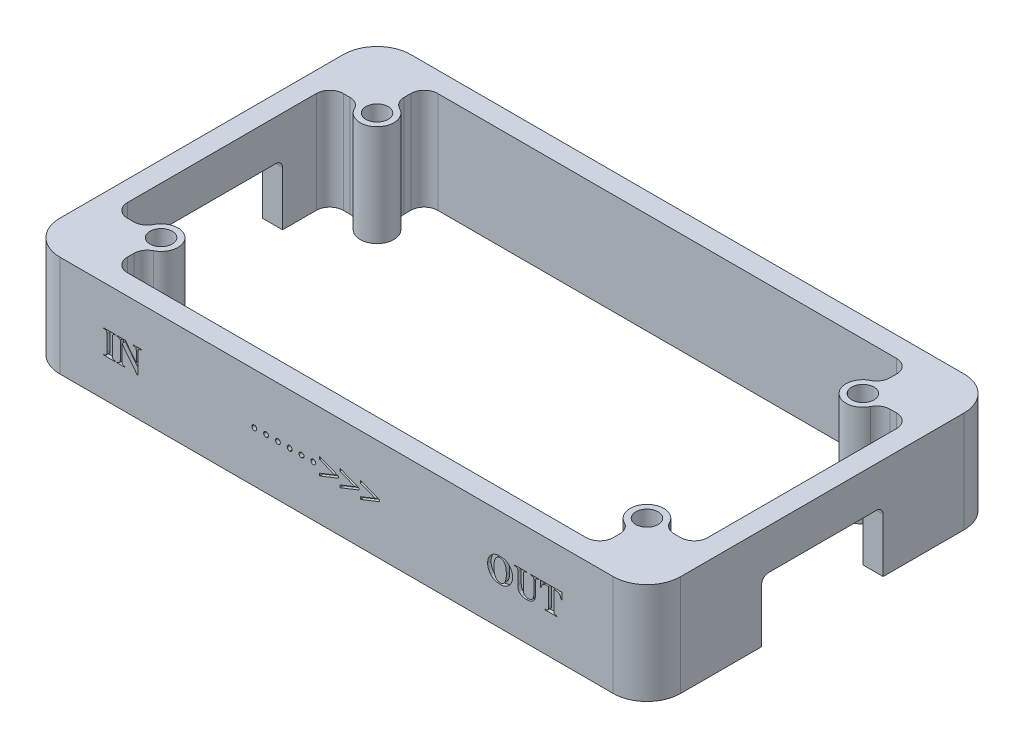
from build123d import *

# Parameters (mm, degrees)
SKETCH_1_W               = 92
SKETCH_1_H               = 52
SKETCH_1_W_2             = 86
SKETCH_1_H_2             = 46
EXTRUDE_1_DEPTH          = 15
SKETCH_2_R               = 1.65
EXTRUDE_3_DEPTH          = 15
CUT_EXTRUDE_1_DEPTH      = 97.772930099
CUT_EXTRUDE_1_DEPTH_BACK = 97.772930099
SKETCH_3_W               = 18
SKETCH_3_H               = 18
FILLET_1_R               = 2
FILLET_2_R               = 5
FILLET_3_R               = 1
CUT_EXTRUDE_2_DEPTH      = 72.028163428
CUT_EXTRUDE_2_DEPTH_BACK = 0.5
CUT_EXTRUDE_3_DEPTH      = 0.5


with BuildPart() as part:
    # 草图1 → 凸台-拉伸1 (new body)
    with BuildSketch(Plane(origin=(0, 0, 0), x_dir=(1, 0, 0), z_dir=(0, 1, 0))):
        Rectangle(SKETCH_1_W, SKETCH_1_H)
        Rectangle(SKETCH_1_W_2, SKETCH_1_H_2, mode=Mode.SUBTRACT)
    extrude(amount=EXTRUDE_1_DEPTH)

    # 草图2 → 凸台-拉伸3 (add)
    # profile 1 of 4: a face of its own
    with BuildSketch(Plane.XZ):
        with BuildLine():
            Line((43, 23), (36, 23))
            Line((36, 23), (36, 18.5))
            ThreePointArc((36, 18.5), (34.232233047, 14.232233047), (38.5, 16))
            Line((38.5, 16), (43, 16))
            Line((43, 16), (43, 23))
        make_face()
        with Locations(Location((36, 16, 0), (0, 0, 270))):
            Circle(SKETCH_2_R, mode=Mode.SUBTRACT)
    # profile 2 of 4: a face of its own
    with BuildSketch(Plane.XZ):
        with BuildLine():
            Line((36, -18.5), (36, -23))
            Line((36, -23), (43, -23))
            Line((43, -23), (43, -16))
            Line((43, -16), (38.5, -16))
            ThreePointArc((38.5, -16), (34.232233047, -14.232233047), (36, -18.5))
        make_face()
        with Locations(Location((36, -16, 0), (0, 0, 270))):
            Circle(SKETCH_2_R, mode=Mode.SUBTRACT)
    # profile 3 of 4: a face of its own
    with BuildSketch(Plane.XZ):
        with BuildLine():
            Line((-38.5, -16), (-43, -16))
            Line((-43, -16), (-43, -23))
            Line((-43, -23), (-36, -23))
            Line((-36, -23), (-36, -18.5))
            ThreePointArc((-36, -18.5), (-34.232233047, -14.232233047), (-38.5, -16))
        make_face()
        with Locations(Location((-36, -16, 0), (0, 0, 270))):
            Circle(SKETCH_2_R, mode=Mode.SUBTRACT)
    # profile 4 of 4: a face of its own
    with BuildSketch(Plane.XZ):
        with BuildLine():
            Line((-43, 16), (-38.5, 16))
            ThreePointArc((-38.5, 16), (-34.232233047, 14.232233047), (-36, 18.5))
            Line((-36, 18.5), (-36, 23))
            Line((-36, 23), (-43, 23))
            Line((-43, 23), (-43, 16))
        make_face()
        with BuildLine():
            ThreePointArc((-36, 17.65), (-34.833273811, 17.166726189), (-34.35, 16))
            ThreePointArc((-34.35, 16), (-37.166726189, 14.833273811), (-36, 17.65))
        make_face(mode=Mode.SUBTRACT)
    extrude(amount=-EXTRUDE_3_DEPTH)

    # 草图3 → 切除-拉伸1 (cut, two sides: drawn at the far end of the back side and taken through both)
    with BuildSketch(Plane(origin=(46, 0, 0), x_dir=(0, 0, -1), z_dir=(1, 0, 0)).offset(-CUT_EXTRUDE_1_DEPTH_BACK)):
        Rectangle(SKETCH_3_W, SKETCH_3_H)
    extrude(amount=CUT_EXTRUDE_1_DEPTH + CUT_EXTRUDE_1_DEPTH_BACK, mode=Mode.SUBTRACT)

    # 圆角1
    fillet_1_edges = [part.edges().sort_by_distance(p)[0] for p in [
        (-38.5, 7.5, 16),
        (-43, 7.5, 16),
        (-36, 7.5, 23),
        (-36, 7.5, 18.5),
        (-36, 7.5, -18.5),
        (-36, 7.5, -23),
        (-43, 7.5, -16),
        (-38.5, 7.5, -16),
        (38.5, 7.5, -16),
        (43, 7.5, -16),
        (36, 7.5, -23),
        (36, 7.5, -18.5),
        (36, 7.5, 18.5),
        (36, 7.5, 23),
        (43, 7.5, 16),
        (38.5, 7.5, 16),
    ]]
    fillet(fillet_1_edges, radius=FILLET_1_R)

    # 圆角2
    fillet_2_edges = [part.edges().sort_by_distance(p)[0] for p in [
        (46, 7.5, -26),
        (46, 7.5, 26),
        (-46, 7.5, 26),
        (-46, 7.5, -26),
    ]]
    fillet(fillet_2_edges, radius=FILLET_2_R)

    # 圆角3
    fillet_3_edges = [part.edges().sort_by_distance(p)[0] for p in [
        (-44.5, 9, -9),
        (44.5, 9, 9),
        (-44.5, 9, 9),
        (44.5, 9, -9),
    ]]
    fillet(fillet_3_edges, radius=FILLET_3_R)

    # 草图4 → 切除-拉伸2 (cut, two sides: drawn at the far end of the back side and taken through both)
    # profile 1 of 14: a face of its own
    with BuildSketch(Plane.XY.offset(26).offset(-CUT_EXTRUDE_2_DEPTH_BACK)):
        with BuildLine():
            Line((-32.732653128, 5.775486655), (-32.732653128, 5.678264433))
            Line((-32.732653128, 5.678264433), (-34.531264239, 5.678264433))
            Line((-34.531264239, 5.678264433), (-34.531264239, 5.775486655))
            Line((-34.531264239, 5.775486655), (-34.416572399, 5.775486655))
            add(Edge.make_bspline(
                [(-34.416572399, 5.775486655), (-34.392728742, 5.775932045), (-34.347343825, 5.776779819), (-34.282845331, 5.786855491), (-34.225272065, 5.802812289), (-34.191284187, 5.819782655), (-34.175035941, 5.827895509)],
                knots=[0, 0, 0, 0, 1.144467932, 2.17842344, 3.129177061, 4, 4, 4, 4], degree=3))
            add(Edge.make_bspline(
                [(-34.175035941, 5.827895509), (-34.164361457, 5.8343349), (-34.142769434, 5.847360306), (-34.11503857, 5.874951651), (-34.091538792, 5.908585161), (-34.079474423, 5.934030216), (-34.073256427, 5.947144641)],
                knots=[0, 0, 0, 0, 0.93343552, 1.888125192, 2.911536119, 4, 4, 4, 4], degree=3))
            add(Edge.make_bspline(
                [(-34.073256427, 5.947144641), (-34.070775548, 5.953160884), (-34.065124207, 5.966865644), (-34.060922435, 5.991442302), (-34.054829779, 6.021358104), (-34.051755265, 6.057760795), (-34.04865372, 6.100280041), (-34.046236127, 6.148653651), (-34.045982588, 6.203114321), (-34.045440385, 6.24134389), (-34.045153128, 6.261597766)],
                knots=[0, 0, 0, 0, 0.491154816, 1.118830903, 1.878082211, 2.802823963, 3.878617243, 5.106317376, 6.466938293, 8, 8, 8, 8], degree=3))
            Line((-34.045153128, 6.261597766), (-34.045153128, 8.594931099))
            add(Edge.make_bspline(
                [(-34.045153128, 8.594931099), (-34.045443774, 8.615438023), (-34.045999953, 8.654679949), (-34.046205286, 8.710408178), (-34.048673312, 8.760042471), (-34.051710086, 8.803334426), (-34.055024861, 8.840951014), (-34.060734588, 8.872217536), (-34.06526936, 8.897944138), (-34.074827434, 8.923705644), (-34.090050014, 8.951857662), (-34.115846708, 8.981530318), (-34.148233364, 9.008941866), (-34.187273487, 9.034218232), (-34.233836767, 9.055698505), (-34.288237953, 9.070362985), (-34.349922934, 9.079613298), (-34.393495116, 9.080547452), (-34.416572399, 9.081042211)],
                knots=[0, 0, 0, 0, 1.353963977, 2.590937397, 3.678525439, 4.633585292, 5.456840327, 6.168525469, 6.732370981, 7.176481794, 7.976852204, 8.830756602, 9.755347706, 10.770665926, 11.892520065, 13.125421506, 14.477527201, 16, 16, 16, 16], degree=3))
            Line((-34.416572399, 9.081042211), (-34.531264239, 9.081042211))
            Line((-34.531264239, 9.081042211), (-34.531264239, 9.178264433))
            Line((-34.531264239, 9.178264433), (-32.732653128, 9.178264433))
            Line((-32.732653128, 9.178264433), (-32.732653128, 9.081042211))
            Line((-32.732653128, 9.081042211), (-32.84658542, 9.081042211))
            add(Edge.make_bspline(
                [(-32.84658542, 9.081042211), (-32.870426366, 9.080587508), (-32.915806123, 9.07972201), (-32.980098935, 9.069803383), (-33.037329444, 9.05355607), (-33.071109395, 9.036729376), (-33.087362329, 9.028633356)],
                knots=[0, 0, 0, 0, 1.147815573, 2.184795468, 3.126629849, 4, 4, 4, 4], degree=3))
            add(Edge.make_bspline(
                [(-33.087362329, 9.028633356), (-33.098047204, 9.022201981), (-33.119660247, 9.00919279), (-33.147331627, 8.981369352), (-33.171645976, 8.948028455), (-33.184199439, 8.922515974), (-33.190660941, 8.909384224)],
                knots=[0, 0, 0, 0, 0.928829741, 1.878808762, 2.908183361, 4, 4, 4, 4], degree=3))
            add(Edge.make_bspline(
                [(-33.190660941, 8.909384224), (-33.193130423, 8.903365748), (-33.198661755, 8.88988511), (-33.203201517, 8.86538146), (-33.208971173, 8.835401725), (-33.212196264, 8.798774204), (-33.215225455, 8.756498592), (-33.217717684, 8.708130333), (-33.217920287, 8.65366718), (-33.218473223, 8.615184805), (-33.218764239, 8.594931099)],
                knots=[0, 0, 0, 0, 0.491143652, 1.100100526, 1.878201893, 2.802922625, 3.87869145, 5.087223688, 6.466973141, 8, 8, 8, 8], degree=3))
            Line((-33.218764239, 8.594931099), (-33.218764239, 6.261597766))
            add(Edge.make_bspline(
                [(-33.218764239, 6.261597766), (-33.218483111, 6.241090214), (-33.217945145, 6.201847086), (-33.217617223, 6.146126949), (-33.215536499, 6.096447117), (-33.211281787, 6.052963244), (-33.2078974, 6.015416062), (-33.203520424, 5.983634217), (-33.197756599, 5.95817739), (-33.188623574, 5.932036715), (-33.171880111, 5.904816871), (-33.146673338, 5.874932933), (-33.114127622, 5.847607089), (-33.07513634, 5.822304406), (-33.028557945, 5.80083228), (-32.974161356, 5.786165313), (-32.912726013, 5.776953253), (-32.86940868, 5.775992737), (-32.84658542, 5.775486655)],
                knots=[0, 0, 0, 0, 1.354319329, 2.591617395, 3.679490877, 4.636117144, 5.476222309, 6.168990776, 6.752950479, 7.19717785, 7.991448918, 8.845577426, 9.770411191, 10.785995884, 11.908144457, 13.141369476, 14.493830035, 16, 16, 16, 16], degree=3))
            Line((-32.84658542, 5.775486655), (-32.732653128, 5.775486655))
        make_face()
    # profile 2 of 14: a face of its own
    with BuildSketch(Plane.XY.offset(26).offset(-CUT_EXTRUDE_2_DEPTH_BACK)):
        with BuildLine():
            Line((-31.301663545, 9.178264433), (-29.670153128, 7.10697537))
            Line((-29.670153128, 7.10697537), (-29.670153128, 8.497708877))
            add(Edge.make_bspline(
                [(-29.670153128, 8.497708877), (-29.670503777, 8.523535447), (-29.671174534, 8.572939248), (-29.674585054, 8.643699451), (-29.681752183, 8.707757588), (-29.690058533, 8.765850565), (-29.703292023, 8.81692061), (-29.717440484, 8.861886381), (-29.734546349, 8.900518162), (-29.749587131, 8.92248238), (-29.75674167, 8.932930231)],
                knots=[0, 0, 0, 0, 1.37708922, 2.634242248, 3.774587307, 4.813165717, 5.759297908, 6.583135444, 7.326031535, 8, 8, 8, 8], degree=3))
            add(Edge.make_bspline(
                [(-29.75674167, 8.932930231), (-29.76731642, 8.945133215), (-29.788497145, 8.969575215), (-29.826238422, 9.001040835), (-29.869111402, 9.026862626), (-29.916977133, 9.047454597), (-29.969749886, 9.063270896), (-30.027467493, 9.074635562), (-30.090309773, 9.080545449), (-30.133719473, 9.080872406), (-30.156264239, 9.081042211)],
                knots=[0, 0, 0, 0, 0.876036587, 1.754659902, 2.655600339, 3.585565811, 4.577428142, 5.642743129, 6.775761992, 8, 8, 8, 8], degree=3))
            Line((-30.156264239, 9.081042211), (-30.156264239, 9.178264433))
            Line((-30.156264239, 9.178264433), (-28.940986461, 9.178264433))
            Line((-28.940986461, 9.178264433), (-28.940986461, 9.081042211))
            add(Edge.make_bspline(
                [(-28.940986461, 9.081042211), (-28.977023625, 9.076506553), (-29.042829264, 9.068224218), (-29.131258263, 9.049757736), (-29.201064877, 9.031078351), (-29.254628355, 9.008836063), (-29.295564951, 8.980100892), (-29.329072616, 8.945082835), (-29.359039122, 8.903598986), (-29.385184167, 8.853071376), (-29.405030006, 8.789006526), (-29.417494146, 8.708267244), (-29.42559641, 8.609273955), (-29.42656926, 8.536972631), (-29.427097572, 8.497708877)],
                knots=[0, 0, 0, 0, 1.47293099, 2.689644668, 3.661742309, 4.402208035, 5.02909861, 5.67554278, 6.359727415, 7.099337769, 7.973129416, 9.067356349, 10.407406766, 12, 12, 12, 12], degree=3))
            Line((-29.427097572, 8.497708877), (-29.427097572, 5.629653322))
            Line((-29.427097572, 5.629653322), (-29.538751218, 5.629653322))
            Line((-29.538751218, 5.629653322), (-31.809042017, 8.513659398))
            Line((-31.809042017, 8.513659398), (-31.809042017, 6.261597766))
            add(Edge.make_bspline(
                [(-31.809042017, 6.261597766), (-31.808484104, 6.238805577), (-31.807410132, 6.194931014), (-31.802638756, 6.131882123), (-31.792717027, 6.074728475), (-31.779132102, 6.023308051), (-31.761836566, 5.977603503), (-31.740758724, 5.937283532), (-31.714451191, 5.903710652), (-31.675842048, 5.866073852), (-31.620877042, 5.830462203), (-31.550522695, 5.798405684), (-31.475394975, 5.778706594), (-31.42355964, 5.776567542), (-31.39736667, 5.775486655)],
                knots=[0, 0, 0, 0, 1.127047964, 2.169547561, 3.122229636, 3.990523395, 4.794755099, 5.533929617, 6.229880341, 6.893690072, 8.19195966, 9.44115978, 10.706989644, 12, 12, 12, 12], degree=3))
            Line((-31.39736667, 5.775486655), (-31.322930906, 5.775486655))
            Line((-31.322930906, 5.775486655), (-31.322930906, 5.678264433))
            Line((-31.322930906, 5.678264433), (-32.538208684, 5.678264433))
            Line((-32.538208684, 5.678264433), (-32.538208684, 5.775486655))
            add(Edge.make_bspline(
                [(-32.538208684, 5.775486655), (-32.516423727, 5.776011806), (-32.474560814, 5.77702096), (-32.414149299, 5.782239982), (-32.358682485, 5.790986359), (-32.308606487, 5.804265194), (-32.263226912, 5.818935286), (-32.223260202, 5.837923133), (-32.188822998, 5.861092885), (-32.158541602, 5.887017508), (-32.132901668, 5.917668873), (-32.110900545, 5.952653026), (-32.092705599, 5.992873501), (-32.077655388, 6.037386344), (-32.066348724, 6.086788998), (-32.058257078, 6.140617891), (-32.052646845, 6.199451306), (-32.052285668, 6.240316087), (-32.052097572, 6.261597766)],
                knots=[0, 0, 0, 0, 1.302254148, 2.502467739, 3.622024049, 4.653421555, 5.596190003, 6.46934253, 7.287800068, 8.07079221, 8.843923894, 9.666846287, 10.533548967, 11.476317415, 12.471093534, 13.558375583, 14.728443775, 16, 16, 16, 16], degree=3))
            Line((-32.052097572, 6.261597766), (-32.052097572, 8.821276586))
            Line((-32.052097572, 8.821276586), (-32.093872746, 8.87368544))
            add(Edge.make_bspline(
                [(-32.093872746, 8.87368544), (-32.11127871, 8.892977936), (-32.144057674, 8.929309622), (-32.19465273, 8.975635575), (-32.242226297, 9.011270132), (-32.28824774, 9.038428858), (-32.338154748, 9.055902545), (-32.394472772, 9.070076535), (-32.460317937, 9.077414223), (-32.507310096, 9.079788219), (-32.532132295, 9.081042211)],
                knots=[0, 0, 0, 0, 1.235439228, 2.326582838, 3.256262787, 4.059856782, 4.856199611, 5.761619077, 6.817642388, 8, 8, 8, 8], degree=3))
            Line((-32.532132295, 9.081042211), (-32.532132295, 9.178264433))
            Line((-32.532132295, 9.178264433), (-31.301663545, 9.178264433))
        make_face()
    # profile 3 of 14: a face of its own
    with BuildSketch(Plane.XY.offset(26).offset(-CUT_EXTRUDE_2_DEPTH_BACK)):
        with BuildLine():
            add(Edge.make_bspline(
                [(-12.194458684, 7.865764433), (-12.170019938, 7.864443806), (-12.122080483, 7.861853243), (-12.053064248, 7.841551165), (-11.99013612, 7.807125406), (-11.934762327, 7.760307703), (-11.888782011, 7.704644114), (-11.854041151, 7.642647986), (-11.833800284, 7.574321574), (-11.831200627, 7.526883576), (-11.82987535, 7.502700197)],
                knots=[0, 0, 0, 0, 1.025415426, 2.011472139, 2.991777189, 4.018460227, 5.038345978, 6.009319269, 6.985172438, 8, 8, 8, 8], degree=3))
            add(Edge.make_bspline(
                [(-11.82987535, 7.502700197), (-11.831181742, 7.478009272), (-11.833731543, 7.429817815), (-11.854113158, 7.360172829), (-11.889167043, 7.297182156), (-11.936075481, 7.241496972), (-11.991876011, 7.195256039), (-12.054363204, 7.160955261), (-12.122819651, 7.140489289), (-12.170269343, 7.137911762), (-12.194458684, 7.136597766)],
                knots=[0, 0, 0, 0, 1.031574786, 2.013415588, 3.003898119, 4.026191547, 5.041716748, 6.017830478, 6.98951136, 8, 8, 8, 8], degree=3))
            add(Edge.make_bspline(
                [(-12.194458684, 7.136597766), (-12.218894852, 7.13792169), (-12.26682925, 7.140518723), (-12.335882222, 7.160773798), (-12.398527921, 7.195299883), (-12.454346628, 7.241279275), (-12.500587078, 7.297234815), (-12.534674467, 7.360367578), (-12.555229192, 7.429797283), (-12.557750317, 7.478002316), (-12.559042017, 7.502700197)],
                knots=[0, 0, 0, 0, 1.019898698, 2.000650433, 2.975681448, 3.990080221, 5.004478993, 5.988817711, 6.969569446, 8, 8, 8, 8], degree=3))
            add(Edge.make_bspline(
                [(-12.559042017, 7.502700197), (-12.55771674, 7.526883576), (-12.555117083, 7.574321574), (-12.534876216, 7.642647986), (-12.500135356, 7.704644114), (-12.45415504, 7.760307703), (-12.398781247, 7.807125406), (-12.33585312, 7.841551165), (-12.266836884, 7.861853243), (-12.218897429, 7.864443806), (-12.194458684, 7.865764433)],
                knots=[0, 0, 0, 0, 1.014827562, 1.990680731, 2.961654022, 3.981539773, 5.008222811, 5.988527861, 6.974584574, 8, 8, 8, 8], degree=3))
        make_face()
    # profile 4 of 14: a face of its own
    with BuildSketch(Plane.XY.offset(26).offset(-CUT_EXTRUDE_2_DEPTH_BACK)):
        with BuildLine():
            add(Edge.make_bspline(
                [(-10.444458684, 7.865764433), (-10.420019938, 7.864443806), (-10.372080483, 7.861853243), (-10.303064248, 7.841551165), (-10.24013612, 7.807125406), (-10.184762327, 7.760307703), (-10.138782011, 7.704644114), (-10.104041151, 7.642647986), (-10.083800284, 7.574321574), (-10.081200627, 7.526883576), (-10.07987535, 7.502700197)],
                knots=[0, 0, 0, 0, 1.025415426, 2.011472139, 2.991777189, 4.018460227, 5.038345978, 6.009319269, 6.985172438, 8, 8, 8, 8], degree=3))
            add(Edge.make_bspline(
                [(-10.07987535, 7.502700197), (-10.081181742, 7.478009272), (-10.083731543, 7.429817815), (-10.104113158, 7.360172829), (-10.139167043, 7.297182156), (-10.186075481, 7.241496972), (-10.241876011, 7.195256039), (-10.304363204, 7.160955261), (-10.372819651, 7.140489289), (-10.420269343, 7.137911762), (-10.444458684, 7.136597766)],
                knots=[0, 0, 0, 0, 1.031574786, 2.013415588, 3.003898119, 4.026191547, 5.041716748, 6.017830478, 6.98951136, 8, 8, 8, 8], degree=3))
            add(Edge.make_bspline(
                [(-10.444458684, 7.136597766), (-10.468894852, 7.13792169), (-10.51682925, 7.140518723), (-10.585882222, 7.160773798), (-10.648527921, 7.195299883), (-10.704346628, 7.241279275), (-10.750587078, 7.297234815), (-10.784674467, 7.360367578), (-10.805229192, 7.429797283), (-10.807750317, 7.478002316), (-10.809042017, 7.502700197)],
                knots=[0, 0, 0, 0, 1.019898698, 2.000650433, 2.975681448, 3.990080221, 5.004478993, 5.988817711, 6.969569446, 8, 8, 8, 8], degree=3))
            add(Edge.make_bspline(
                [(-10.809042017, 7.502700197), (-10.80771674, 7.526883576), (-10.805117083, 7.574321574), (-10.784876216, 7.642647986), (-10.750135356, 7.704644114), (-10.70415504, 7.760307703), (-10.648781247, 7.807125406), (-10.58585312, 7.841551165), (-10.516836884, 7.861853243), (-10.468897429, 7.864443806), (-10.444458684, 7.865764433)],
                knots=[0, 0, 0, 0, 1.014827562, 1.990680731, 2.961654022, 3.981539773, 5.008222811, 5.988527861, 6.974584574, 8, 8, 8, 8], degree=3))
        make_face()
    # profile 5 of 14: a face of its own
    with BuildSketch(Plane.XY.offset(26).offset(-CUT_EXTRUDE_2_DEPTH_BACK)):
        with BuildLine():
            add(Edge.make_bspline(
                [(-8.694458684, 7.865764433), (-8.670019938, 7.864443806), (-8.622080483, 7.861853243), (-8.553064248, 7.841551165), (-8.49013612, 7.807125406), (-8.434762327, 7.760307703), (-8.388782011, 7.704644114), (-8.354041151, 7.642647986), (-8.333800284, 7.574321574), (-8.331200627, 7.526883576), (-8.32987535, 7.502700197)],
                knots=[0, 0, 0, 0, 1.025415426, 2.011472139, 2.991777189, 4.018460227, 5.038345978, 6.009319269, 6.985172438, 8, 8, 8, 8], degree=3))
            add(Edge.make_bspline(
                [(-8.32987535, 7.502700197), (-8.331181742, 7.478009272), (-8.333731543, 7.429817815), (-8.354113158, 7.360172829), (-8.389167043, 7.297182156), (-8.436075481, 7.241496972), (-8.491876011, 7.195256039), (-8.554363204, 7.160955261), (-8.622819651, 7.140489289), (-8.670269343, 7.137911762), (-8.694458684, 7.136597766)],
                knots=[0, 0, 0, 0, 1.031574786, 2.013415588, 3.003898119, 4.026191547, 5.041716748, 6.017830478, 6.98951136, 8, 8, 8, 8], degree=3))
            add(Edge.make_bspline(
                [(-8.694458684, 7.136597766), (-8.718894852, 7.13792169), (-8.76682925, 7.140518723), (-8.835882222, 7.160773798), (-8.898527921, 7.195299883), (-8.954346628, 7.241279275), (-9.000587078, 7.297234815), (-9.034674467, 7.360367578), (-9.055229192, 7.429797283), (-9.057750317, 7.478002316), (-9.059042017, 7.502700197)],
                knots=[0, 0, 0, 0, 1.019898698, 2.000650433, 2.975681448, 3.990080221, 5.004478993, 5.988817711, 6.969569446, 8, 8, 8, 8], degree=3))
            add(Edge.make_bspline(
                [(-9.059042017, 7.502700197), (-9.05771674, 7.526883576), (-9.055117083, 7.574321574), (-9.034876216, 7.642647986), (-9.000135356, 7.704644114), (-8.95415504, 7.760307703), (-8.898781247, 7.807125406), (-8.83585312, 7.841551165), (-8.766836884, 7.861853243), (-8.718897429, 7.864443806), (-8.694458684, 7.865764433)],
                knots=[0, 0, 0, 0, 1.014827562, 1.990680731, 2.961654022, 3.981539773, 5.008222811, 5.988527861, 6.974584574, 8, 8, 8, 8], degree=3))
        make_face()
    # profile 6 of 14: a face of its own
    with BuildSketch(Plane.XY.offset(26).offset(-CUT_EXTRUDE_2_DEPTH_BACK)):
        with BuildLine():
            add(Edge.make_bspline(
                [(-6.944458684, 7.865764433), (-6.920019938, 7.864443806), (-6.872080483, 7.861853243), (-6.803064248, 7.841551165), (-6.74013612, 7.807125406), (-6.684762327, 7.760307703), (-6.638782011, 7.704644114), (-6.604041151, 7.642647986), (-6.583800284, 7.574321574), (-6.581200627, 7.526883576), (-6.57987535, 7.502700197)],
                knots=[0, 0, 0, 0, 1.025415426, 2.011472139, 2.991777189, 4.018460227, 5.038345978, 6.009319269, 6.985172438, 8, 8, 8, 8], degree=3))
            add(Edge.make_bspline(
                [(-6.57987535, 7.502700197), (-6.581181742, 7.478009272), (-6.583731543, 7.429817815), (-6.604113158, 7.360172829), (-6.639167043, 7.297182156), (-6.686075481, 7.241496972), (-6.741876011, 7.195256039), (-6.804363204, 7.160955261), (-6.872819651, 7.140489289), (-6.920269343, 7.137911762), (-6.944458684, 7.136597766)],
                knots=[0, 0, 0, 0, 1.031574786, 2.013415588, 3.003898119, 4.026191547, 5.041716748, 6.017830478, 6.98951136, 8, 8, 8, 8], degree=3))
            add(Edge.make_bspline(
                [(-6.944458684, 7.136597766), (-6.968894852, 7.13792169), (-7.01682925, 7.140518723), (-7.085882222, 7.160773798), (-7.148527921, 7.195299883), (-7.204346628, 7.241279275), (-7.250587078, 7.297234815), (-7.284674467, 7.360367578), (-7.305229192, 7.429797283), (-7.307750317, 7.478002316), (-7.309042017, 7.502700197)],
                knots=[0, 0, 0, 0, 1.019898698, 2.000650433, 2.975681448, 3.990080221, 5.004478993, 5.988817711, 6.969569446, 8, 8, 8, 8], degree=3))
            add(Edge.make_bspline(
                [(-7.309042017, 7.502700197), (-7.30771674, 7.526883576), (-7.305117083, 7.574321574), (-7.284876216, 7.642647986), (-7.250135356, 7.704644114), (-7.20415504, 7.760307703), (-7.148781247, 7.807125406), (-7.08585312, 7.841551165), (-7.016836884, 7.861853243), (-6.968897429, 7.864443806), (-6.944458684, 7.865764433)],
                knots=[0, 0, 0, 0, 1.014827562, 1.990680731, 2.961654022, 3.981539773, 5.008222811, 5.988527861, 6.974584574, 8, 8, 8, 8], degree=3))
        make_face()
    # profile 7 of 14: a face of its own
    with BuildSketch(Plane.XY.offset(26).offset(-CUT_EXTRUDE_2_DEPTH_BACK)):
        with BuildLine():
            add(Edge.make_bspline(
                [(-5.194458684, 7.865764433), (-5.170019938, 7.864443806), (-5.122080483, 7.861853243), (-5.053064248, 7.841551165), (-4.99013612, 7.807125406), (-4.934762327, 7.760307703), (-4.888782011, 7.704644114), (-4.854041151, 7.642647986), (-4.833800284, 7.574321574), (-4.831200627, 7.526883576), (-4.82987535, 7.502700197)],
                knots=[0, 0, 0, 0, 1.025415426, 2.011472139, 2.991777189, 4.018460227, 5.038345978, 6.009319269, 6.985172438, 8, 8, 8, 8], degree=3))
            add(Edge.make_bspline(
                [(-4.82987535, 7.502700197), (-4.831181742, 7.478009272), (-4.833731543, 7.429817815), (-4.854113158, 7.360172829), (-4.889167043, 7.297182156), (-4.936075481, 7.241496972), (-4.991876011, 7.195256039), (-5.054363204, 7.160955261), (-5.122819651, 7.140489289), (-5.170269343, 7.137911762), (-5.194458684, 7.136597766)],
                knots=[0, 0, 0, 0, 1.031574786, 2.013415588, 3.003898119, 4.026191547, 5.041716748, 6.017830478, 6.98951136, 8, 8, 8, 8], degree=3))
            add(Edge.make_bspline(
                [(-5.194458684, 7.136597766), (-5.218894852, 7.13792169), (-5.26682925, 7.140518723), (-5.335882222, 7.160773798), (-5.398527921, 7.195299883), (-5.454346628, 7.241279275), (-5.500587078, 7.297234815), (-5.534674467, 7.360367578), (-5.555229192, 7.429797283), (-5.557750317, 7.478002316), (-5.559042017, 7.502700197)],
                knots=[0, 0, 0, 0, 1.019898698, 2.000650433, 2.975681448, 3.990080221, 5.004478993, 5.988817711, 6.969569446, 8, 8, 8, 8], degree=3))
            add(Edge.make_bspline(
                [(-5.559042017, 7.502700197), (-5.55771674, 7.526883576), (-5.555117083, 7.574321574), (-5.534876216, 7.642647986), (-5.500135356, 7.704644114), (-5.45415504, 7.760307703), (-5.398781247, 7.807125406), (-5.33585312, 7.841551165), (-5.266836884, 7.861853243), (-5.218897429, 7.864443806), (-5.194458684, 7.865764433)],
                knots=[0, 0, 0, 0, 1.014827562, 1.990680731, 2.961654022, 3.981539773, 5.008222811, 5.988527861, 6.974584574, 8, 8, 8, 8], degree=3))
        make_face()
    # profile 8 of 14: a face of its own
    with BuildSketch(Plane.XY.offset(26).offset(-CUT_EXTRUDE_2_DEPTH_BACK)):
        with BuildLine():
            add(Edge.make_bspline(
                [(-3.444458684, 7.865764433), (-3.420019938, 7.864443806), (-3.372080483, 7.861853243), (-3.303064248, 7.841551165), (-3.24013612, 7.807125406), (-3.184762327, 7.760307703), (-3.138782011, 7.704644114), (-3.104041151, 7.642647986), (-3.083800284, 7.574321574), (-3.081200627, 7.526883576), (-3.07987535, 7.502700197)],
                knots=[0, 0, 0, 0, 1.025415426, 2.011472139, 2.991777189, 4.018460227, 5.038345978, 6.009319269, 6.985172438, 8, 8, 8, 8], degree=3))
            add(Edge.make_bspline(
                [(-3.07987535, 7.502700197), (-3.081181742, 7.478009272), (-3.083731543, 7.429817815), (-3.104113158, 7.360172829), (-3.139167043, 7.297182156), (-3.186075481, 7.241496972), (-3.241876011, 7.195256039), (-3.304363204, 7.160955261), (-3.372819651, 7.140489289), (-3.420269343, 7.137911762), (-3.444458684, 7.136597766)],
                knots=[0, 0, 0, 0, 1.031574786, 2.013415588, 3.003898119, 4.026191547, 5.041716748, 6.017830478, 6.98951136, 8, 8, 8, 8], degree=3))
            add(Edge.make_bspline(
                [(-3.444458684, 7.136597766), (-3.468894852, 7.13792169), (-3.51682925, 7.140518723), (-3.585882222, 7.160773798), (-3.648527921, 7.195299883), (-3.704346628, 7.241279275), (-3.750587078, 7.297234815), (-3.784674467, 7.360367578), (-3.805229192, 7.429797283), (-3.807750317, 7.478002316), (-3.809042017, 7.502700197)],
                knots=[0, 0, 0, 0, 1.019898698, 2.000650433, 2.975681448, 3.990080221, 5.004478993, 5.988817711, 6.969569446, 8, 8, 8, 8], degree=3))
            add(Edge.make_bspline(
                [(-3.809042017, 7.502700197), (-3.80771674, 7.526883576), (-3.805117083, 7.574321574), (-3.784876216, 7.642647986), (-3.750135356, 7.704644114), (-3.70415504, 7.760307703), (-3.648781247, 7.807125406), (-3.58585312, 7.841551165), (-3.516836884, 7.861853243), (-3.468897429, 7.864443806), (-3.444458684, 7.865764433)],
                knots=[0, 0, 0, 0, 1.014827562, 1.990680731, 2.961654022, 3.981539773, 5.008222811, 5.988527861, 6.974584574, 8, 8, 8, 8], degree=3))
        make_face()
    # profile 9 of 14: a face of its own
    with BuildSketch(Plane.XY.offset(26).offset(-CUT_EXTRUDE_2_DEPTH_BACK)):
        Polygon((-2.496542017, 8.643542211), (0.322902428, 7.525486655), (0.322902428, 7.282431099), (-2.496542017, 6.164375544), (-2.496542017, 6.52743978), (-0.283976913, 7.404718426), (-2.496542017, 8.281997072), align=None)
    # profile 10 of 14: a face of its own
    with BuildSketch(Plane.XY.offset(26).offset(-CUT_EXTRUDE_2_DEPTH_BACK)):
        Polygon((0.517346872, 8.643542211), (3.336791316, 7.525486655), (3.336791316, 7.282431099), (0.517346872, 6.164375544), (0.517346872, 6.52743978), (2.729911976, 7.404718426), (0.517346872, 8.281997072), align=None)
    # profile 11 of 14: a face of its own
    with BuildSketch(Plane.XY.offset(26).offset(-CUT_EXTRUDE_2_DEPTH_BACK)):
        Polygon((3.531235761, 8.643542211), (6.350680205, 7.525486655), (6.350680205, 7.282431099), (3.531235761, 6.164375544), (3.531235761, 6.52743978), (5.743800865, 7.404718426), (3.531235761, 8.281997072), align=None)
    # profile 12 of 14: a face of its own
    with BuildSketch(Plane.XY.offset(26).offset(-CUT_EXTRUDE_2_DEPTH_BACK)):
        with BuildLine():
            add(Edge.make_bspline(
                [(24.216782636, 9.226875544), (24.284420171, 9.227930149), (24.416688169, 9.229992473), (24.610721141, 9.210945879), (24.795172156, 9.176392424), (24.97014442, 9.125051705), (25.134658502, 9.055075375), (25.289972176, 8.968879948), (25.43546428, 8.865211301), (25.569368211, 8.745204403), (25.689992475, 8.613007205), (25.796489123, 8.471857838), (25.886568339, 8.322529597), (25.959837608, 8.164824213), (26.017290202, 7.999227096), (26.056976137, 7.825241493), (26.082094112, 7.643441827), (26.085206289, 7.519494127), (26.086791316, 7.456367731)],
                knots=[0, 0, 0, 0, 1.117599178, 2.185511443, 3.216596641, 4.216496892, 5.193720437, 6.166199278, 7.147635958, 8.140749636, 9.133263309, 10.101842832, 11.059452728, 12.010747998, 12.971773146, 13.951566087, 14.956735376, 16, 16, 16, 16], degree=3))
            add(Edge.make_bspline(
                [(26.086791316, 7.456367731), (26.085655135, 7.402135404), (26.083413348, 7.295130155), (26.064660527, 7.137112364), (26.034106469, 6.984070616), (25.99275534, 6.835371585), (25.93772632, 6.692100962), (25.870143042, 6.554341475), (25.792576578, 6.420238272), (25.730644315, 6.336988031), (25.699421525, 6.295017905)],
                knots=[0, 0, 0, 0, 1.043246653, 2.058419255, 3.056808262, 4.043829632, 5.024555343, 6.005002729, 6.994233708, 8, 8, 8, 8], degree=3))
            add(Edge.make_bspline(
                [(25.699421525, 6.295017905), (25.677723516, 6.26789873), (25.634748701, 6.214186818), (25.564973352, 6.13912327), (25.493334423, 6.067924685), (25.416700041, 6.003620496), (25.337903865, 5.94336956), (25.255553546, 5.88838705), (25.169669291, 5.839156501), (25.080668283, 5.79493569), (24.988198465, 5.75626751), (24.892841625, 5.721749756), (24.793401023, 5.694018787), (24.691075107, 5.670314563), (24.585319948, 5.652083083), (24.476517587, 5.639598168), (24.36454232, 5.630476576), (24.28870586, 5.629930547), (24.250202775, 5.629653322)],
                knots=[0, 0, 0, 0, 1.00627325, 1.9930127, 2.968556301, 3.931628562, 4.889992766, 5.842467438, 6.799060146, 7.757311971, 8.720859362, 9.702647782, 10.694476427, 11.710892394, 12.745970349, 13.802697082, 14.884402792, 16, 16, 16, 16], degree=3))
            add(Edge.make_bspline(
                [(24.250202775, 5.629653322), (24.211704354, 5.630005896), (24.135642475, 5.630702481), (24.02314497, 5.63879974), (23.9138393, 5.650541125), (23.807813648, 5.667963047), (23.705403444, 5.691304346), (23.605546879, 5.717007876), (23.509940558, 5.750143077), (23.417518808, 5.787652118), (23.327895419, 5.829006611), (23.241861136, 5.876204193), (23.159739792, 5.928961542), (23.080651343, 5.986031134), (23.004369244, 6.047400044), (22.932134514, 6.114720664), (22.862910227, 6.186764563), (22.81969591, 6.238059366), (22.79794583, 6.263876412)],
                knots=[0, 0, 0, 0, 1.12499151, 2.222661784, 3.294793131, 4.33735381, 5.360698186, 6.364076506, 7.349253377, 8.315262806, 9.278632822, 10.232406028, 11.180767221, 12.129590213, 13.081869556, 14.040110377, 15.013573345, 16, 16, 16, 16], degree=3))
            add(Edge.make_bspline(
                [(22.79794583, 6.263876412), (22.765538432, 6.306126424), (22.701083547, 6.390157224), (22.618420728, 6.524964166), (22.548940675, 6.665724823), (22.491830839, 6.812122087), (22.446848006, 6.964280548), (22.415071567, 7.122358556), (22.395536035, 7.286240686), (22.393420665, 7.397574427), (22.392346872, 7.454089086)],
                knots=[0, 0, 0, 0, 0.995754374, 1.980450006, 2.952842694, 3.929288476, 4.917067138, 5.917621276, 6.942953664, 8, 8, 8, 8], degree=3))
            add(Edge.make_bspline(
                [(22.392346872, 7.454089086), (22.393973877, 7.517206121), (22.397168476, 7.641135442), (22.421706191, 7.823183895), (22.463634606, 7.99687506), (22.521690545, 8.162766872), (22.595456073, 8.320869029), (22.686469623, 8.470549042), (22.794502599, 8.611769065), (22.917571888, 8.743571977), (23.052125002, 8.863386082), (23.195723627, 8.967989328), (23.347678445, 9.053813168), (23.506855278, 9.123705989), (23.673665031, 9.17624609), (23.848353061, 9.210877457), (24.030269513, 9.229939561), (24.1539529, 9.227907704), (24.216782636, 9.226875544)],
                knots=[0, 0, 0, 0, 1.060255294, 2.081794832, 3.079505486, 4.0575798, 5.030022739, 6.005429218, 6.99491703, 8.012249652, 9.030720031, 10.017772549, 10.991257006, 11.957043232, 12.933793802, 13.923226749, 14.945023109, 16, 16, 16, 16], degree=3))
        make_face()
        with BuildLine():
            add(Edge.make_bspline(
                [(24.24716458, 9.032431099), (24.208299016, 9.031082559), (24.132396377, 9.028448923), (24.022499707, 9.004569871), (23.919475604, 8.967702699), (23.824064819, 8.913933261), (23.735263954, 8.846204433), (23.655179879, 8.761694468), (23.581740842, 8.6632204), (23.54070573, 8.589633732), (23.519517011, 8.551636829)],
                knots=[0, 0, 0, 0, 1.010341478, 1.973149883, 2.913323355, 3.848402755, 4.811842333, 5.809142135, 6.868737798, 8, 8, 8, 8], degree=3))
            add(Edge.make_bspline(
                [(23.519517011, 8.551636829), (23.502882884, 8.517239186), (23.468454595, 8.446045071), (23.42873775, 8.330035993), (23.393503374, 8.204050959), (23.364856253, 8.067293066), (23.34323555, 7.919627875), (23.327553744, 7.761470389), (23.317356852, 7.592713945), (23.316433441, 7.476637869), (23.315957983, 7.416871204)],
                knots=[0, 0, 0, 0, 0.787943638, 1.630837067, 2.525905988, 3.487208031, 4.51219802, 5.604605297, 6.766629954, 8, 8, 8, 8], degree=3))
            add(Edge.make_bspline(
                [(23.315957983, 7.416871204), (23.316618553, 7.345946737), (23.317896531, 7.208731936), (23.333733574, 7.010240511), (23.357265296, 6.825971288), (23.391179996, 6.656063826), (23.435051146, 6.50022495), (23.488639894, 6.358666884), (23.551979904, 6.230717398), (23.604196784, 6.154969026), (23.629651559, 6.118043079)],
                knots=[0, 0, 0, 0, 1.253361503, 2.424829634, 3.517270749, 4.535371114, 5.484506921, 6.375489106, 7.20808062, 8, 8, 8, 8], degree=3))
            add(Edge.make_bspline(
                [(23.629651559, 6.118043079), (23.648340779, 6.094507198), (23.684869614, 6.048505367), (23.748485786, 5.988671364), (23.816771632, 5.936982972), (23.89203393, 5.896500352), (23.971361257, 5.862959598), (24.05678017, 5.840533574), (24.147450402, 5.826541845), (24.209893124, 5.824925116), (24.24184774, 5.824097766)],
                knots=[0, 0, 0, 0, 1.020058884, 1.99374635, 2.959073536, 3.921751619, 4.889988268, 5.879249688, 6.914721236, 8, 8, 8, 8], degree=3))
            add(Edge.make_bspline(
                [(24.24184774, 5.824097766), (24.28428221, 5.825269539), (24.366363969, 5.82753612), (24.483584771, 5.853109622), (24.59138991, 5.891184259), (24.653894914, 5.931229234), (24.68466458, 5.950942384)],
                knots=[0, 0, 0, 0, 1.086516288, 2.101667992, 3.065498145, 4, 4, 4, 4], degree=3))
            add(Edge.make_bspline(
                [(24.68466458, 5.950942384), (24.703138267, 5.965073467), (24.740681737, 5.993791606), (24.793288993, 6.043237092), (24.841482147, 6.099896772), (24.887448249, 6.16164363), (24.929851107, 6.229576868), (24.96958107, 6.303239079), (25.004775837, 6.383617459), (25.038755042, 6.469435022), (25.067873502, 6.562185037), (25.094224703, 6.661400744), (25.114548145, 6.767652094), (25.133422345, 6.880225282), (25.146500277, 6.999687038), (25.156662833, 7.125809364), (25.161507558, 7.258848136), (25.162613537, 7.34977523), (25.163180205, 7.396363391)],
                knots=[0, 0, 0, 0, 0.707878774, 1.438598863, 2.192768746, 2.969795667, 3.780358143, 4.628744544, 5.515519471, 6.450279976, 7.437595481, 8.473401936, 9.573958948, 10.729714514, 11.947871327, 13.231394215, 14.581454142, 16, 16, 16, 16], degree=3))
            add(Edge.make_bspline(
                [(25.163180205, 7.396363391), (25.162714909, 7.451309997), (25.161814038, 7.55769325), (25.155705961, 7.711945077), (25.14598924, 7.855578921), (25.132623237, 7.988651346), (25.114880645, 8.110938722), (25.091507796, 8.222247856), (25.066777417, 8.32337901), (25.035789343, 8.41394404), (25.001689728, 8.495593451), (24.96731989, 8.571455456), (24.928889343, 8.640209887), (24.890047134, 8.703977506), (24.846965289, 8.759941289), (24.803042877, 8.810943157), (24.755820862, 8.8547786), (24.691071703, 8.905403853), (24.604448059, 8.957147414), (24.491831182, 9.000333013), (24.372084542, 9.028347323), (24.289352827, 9.031051917), (24.24716458, 9.032431099)],
                knots=[0, 0, 0, 0, 1.564715362, 3.029477591, 4.395383686, 5.663787164, 6.837420581, 7.912070591, 8.901835802, 9.800165859, 10.634314221, 11.421391877, 12.170015688, 12.876189058, 13.5452815, 14.178775877, 14.79090283, 15.376466922, 16.517763855, 17.647800425, 18.800518316, 20, 20, 20, 20], degree=3))
        make_face(mode=Mode.SUBTRACT)
    # profile 13 of 14: a face of its own
    with BuildSketch(Plane.XY.offset(26).offset(-CUT_EXTRUDE_2_DEPTH_BACK)):
        with BuildLine():
            Line((26.378457983, 9.178264433), (28.177069094, 9.178264433))
            Line((28.177069094, 9.178264433), (28.177069094, 9.081042211))
            Line((28.177069094, 9.081042211), (28.091240101, 9.081042211))
            add(Edge.make_bspline(
                [(28.091240101, 9.081042211), (28.061341427, 9.080789344), (28.006742747, 9.080327578), (27.932291942, 9.072753852), (27.87266896, 9.061597054), (27.826124551, 9.044929919), (27.791103258, 9.022220211), (27.762760899, 8.996789334), (27.738489568, 8.968368926), (27.722666653, 8.940613283), (27.713484755, 8.913533795), (27.707719987, 8.886771467), (27.702704102, 8.853777138), (27.697850679, 8.81429576), (27.695355343, 8.768632315), (27.69296205, 8.716479159), (27.691514739, 8.657980627), (27.69115026, 8.616705426), (27.690957983, 8.594931099)],
                knots=[0, 0, 0, 0, 1.873611657, 3.421446737, 4.685315238, 5.669949158, 6.497780211, 7.284732133, 8.050919915, 8.832571355, 9.269293487, 9.839173886, 10.546366176, 11.361468866, 12.331797416, 13.412206959, 14.634835235, 16, 16, 16, 16], degree=3))
            Line((27.690957983, 8.594931099), (27.690957983, 6.860122072))
            add(Edge.make_bspline(
                [(27.690957983, 6.860122072), (27.69093506, 6.82213948), (27.690891189, 6.749443797), (27.695164737, 6.645633739), (27.700083257, 6.551896043), (27.707440243, 6.468247128), (27.717507113, 6.394582065), (27.728098041, 6.330403269), (27.742468257, 6.276622116), (27.763497401, 6.218200406), (27.799027421, 6.155620102), (27.84996601, 6.087045588), (27.913305043, 6.025895658), (27.987219716, 5.972039148), (28.071617716, 5.926100875), (28.168184795, 5.896235682), (28.273893172, 5.875255304), (28.34810474, 5.873580168), (28.386704511, 5.872708877)],
                knots=[0, 0, 0, 0, 1.300992195, 2.489996405, 3.558512469, 4.516486413, 5.365297801, 6.105361831, 6.742819091, 7.269669067, 8.228349452, 9.194533075, 10.188122344, 11.230698299, 12.320957625, 13.461922122, 14.679865887, 16, 16, 16, 16], degree=3))
            add(Edge.make_bspline(
                [(28.386704511, 5.872708877), (28.431127629, 5.874268024), (28.517385901, 5.877295486), (28.641551346, 5.901988778), (28.755556747, 5.94244006), (28.859228826, 5.998794106), (28.950090809, 6.071321069), (29.031612438, 6.154088783), (29.097123707, 6.251778006), (29.144123421, 6.341478903), (29.173889297, 6.423507138), (29.19352991, 6.496427513), (29.209775351, 6.579720232), (29.223345487, 6.673515409), (29.233769563, 6.777678797), (29.241176806, 6.892440186), (29.245732383, 7.017818031), (29.246246234, 7.104945812), (29.246513539, 7.150269641)],
                knots=[0, 0, 0, 0, 1.208075288, 2.345771551, 3.428856258, 4.489532947, 5.539753161, 6.58248904, 7.637421869, 8.72819277, 9.329769644, 10.008360403, 10.78123502, 11.637693061, 12.586496199, 13.629118266, 14.766668491, 16, 16, 16, 16], degree=3))
            Line((29.246513539, 7.150269641), (29.246513539, 8.594931099))
            add(Edge.make_bspline(
                [(29.246513539, 8.594931099), (29.246094644, 8.628137533), (29.245322083, 8.689379591), (29.235862308, 8.773617402), (29.223329139, 8.843436426), (29.200979231, 8.898503951), (29.175367464, 8.942182418), (29.146942, 8.977989108), (29.114899016, 9.006817463), (29.090578598, 9.020436355), (29.078653296, 9.027114259)],
                knots=[0, 0, 0, 0, 1.628272018, 3.002994269, 4.157936954, 5.094593422, 5.902138284, 6.635561567, 7.330959666, 8, 8, 8, 8], degree=3))
            add(Edge.make_bspline(
                [(29.078653296, 9.027114259), (29.058092816, 9.035595511), (29.014204456, 9.053699577), (28.939449278, 9.068860767), (28.85392417, 9.080125088), (28.792859712, 9.080723918), (28.760402428, 9.081042211)],
                knots=[0, 0, 0, 0, 0.819172695, 1.748604514, 2.8033271, 4, 4, 4, 4], degree=3))
            Line((28.760402428, 9.081042211), (28.760402428, 9.178264433))
            Line((28.760402428, 9.178264433), (29.975680205, 9.178264433))
            Line((29.975680205, 9.178264433), (29.975680205, 9.081042211))
            Line((29.975680205, 9.081042211), (29.904282636, 9.081042211))
            add(Edge.make_bspline(
                [(29.904282636, 9.081042211), (29.881193489, 9.080640433), (29.836518139, 9.079863031), (29.772833218, 9.068835801), (29.714745355, 9.052287339), (29.662772869, 9.028911571), (29.61705933, 8.998268119), (29.57891897, 8.960190391), (29.5456975, 8.916432123), (29.530692166, 8.882664757), (29.522989233, 8.865330405)],
                knots=[0, 0, 0, 0, 1.183120061, 2.289227139, 3.304431175, 4.275119626, 5.200974401, 6.11028159, 7.02992005, 8, 8, 8, 8], degree=3))
            add(Edge.make_bspline(
                [(29.522989233, 8.865330405), (29.517765776, 8.850502879), (29.50578116, 8.816482842), (29.496503572, 8.755745749), (29.49075839, 8.680379674), (29.489988691, 8.625078289), (29.489569094, 8.594931099)],
                knots=[0, 0, 0, 0, 0.687610812, 1.577643118, 2.679467964, 4, 4, 4, 4], degree=3))
            Line((29.489569094, 8.594931099), (29.489569094, 7.26040419))
            add(Edge.make_bspline(
                [(29.489569094, 7.26040419), (29.489240462, 7.21052466), (29.488606454, 7.114295435), (29.484829159, 6.975523685), (29.478831278, 6.847633048), (29.470718902, 6.730331247), (29.459749864, 6.623599268), (29.444991096, 6.527950756), (29.429594191, 6.442823782), (29.410382614, 6.36685573), (29.386846157, 6.296479714), (29.354753407, 6.230060926), (29.317042998, 6.164340865), (29.270696708, 6.100676374), (29.218699112, 6.037252049), (29.157807436, 5.976752665), (29.091000858, 5.916464437), (29.017104145, 5.858210864), (28.936011713, 5.804092198), (28.847393597, 5.756687307), (28.751365035, 5.717345369), (28.648302151, 5.685645299), (28.538364533, 5.660601148), (28.421385377, 5.642465167), (28.297019774, 5.631889391), (28.211775699, 5.630412528), (28.167954511, 5.629653322)],
                knots=[0, 0, 0, 0, 1.467844093, 2.831812955, 4.08493233, 5.235248227, 6.291710913, 7.241099964, 8.082787107, 8.836329886, 9.545547297, 10.262123183, 11.003298874, 11.772408823, 12.576590708, 13.414278216, 14.295372854, 15.223952147, 16.180709153, 17.16068275, 18.17626284, 19.229647179, 20.330345869, 21.491588469, 22.710507751, 24, 24, 24, 24], degree=3))
            add(Edge.make_bspline(
                [(28.167954511, 5.629653322), (28.131494048, 5.630224076), (28.060813406, 5.631330516), (27.958102368, 5.636032977), (27.861924819, 5.64657564), (27.771702454, 5.658528916), (27.6882015, 5.676506737), (27.610786155, 5.696483536), (27.540061332, 5.721586276), (27.495884947, 5.741523725), (27.474486629, 5.751181099)],
                knots=[0, 0, 0, 0, 1.233143948, 2.390518333, 3.475011742, 4.504190893, 5.466338132, 6.361429022, 7.206303014, 8, 8, 8, 8], degree=3))
            add(Edge.make_bspline(
                [(27.474486629, 5.751181099), (27.447473878, 5.765300246), (27.394670474, 5.792899767), (27.320034319, 5.838714971), (27.251071558, 5.886874017), (27.190047405, 5.940055292), (27.132860279, 5.993731324), (27.082652137, 6.051444168), (27.039606985, 6.112793273), (27.000520005, 6.176146901), (26.969035848, 6.244899925), (26.940435394, 6.318001651), (26.917461126, 6.39721015), (26.897496281, 6.481556788), (26.882437004, 6.571637825), (26.871960609, 6.66723887), (26.865989345, 6.7686468), (26.865051393, 6.838087342), (26.864569094, 6.873793947)],
                knots=[0, 0, 0, 0, 1.072795036, 2.097055156, 3.081442936, 4.029903069, 4.944023557, 5.841256263, 6.716841961, 7.580550424, 8.457767987, 9.374838938, 10.342169353, 11.35836906, 12.425185407, 13.555221897, 14.742885322, 16, 16, 16, 16], degree=3))
            Line((26.864569094, 6.873793947), (26.864569094, 8.594931099))
            add(Edge.make_bspline(
                [(26.864569094, 8.594931099), (26.864350477, 8.616704159), (26.863933526, 8.658230033), (26.862804769, 8.717263482), (26.859423416, 8.769904448), (26.856260814, 8.815850822), (26.850506014, 8.855297582), (26.845074124, 8.888453545), (26.837613967, 8.915181917), (26.826443545, 8.942200004), (26.807468042, 8.969568224), (26.779470217, 8.998306025), (26.744810625, 9.023413055), (26.701860281, 9.045639603), (26.645927515, 9.063590374), (26.573020618, 9.074400149), (26.481882534, 9.080927565), (26.414931674, 9.08100178), (26.378457983, 9.081042211)],
                knots=[0, 0, 0, 0, 1.241640786, 2.368074092, 3.365879334, 4.249471888, 4.992646898, 5.63827609, 6.16378018, 6.571345593, 7.300077646, 8.045353014, 8.850967868, 9.729118509, 10.792840363, 12.183643133, 13.920913603, 16, 16, 16, 16], degree=3))
            Line((26.378457983, 9.081042211), (26.378457983, 9.178264433))
        make_face()
    # profile 14 of 14: a face of its own
    with BuildSketch(Plane.XY.offset(26).offset(-CUT_EXTRUDE_2_DEPTH_BACK)):
        with BuildLine():
            Line((33.378457983, 9.178264433), (33.378457983, 8.206042211))
            Line((33.378457983, 8.206042211), (33.281235761, 8.206042211))
            add(Edge.make_bspline(
                [(33.281235761, 8.206042211), (33.268163064, 8.255837939), (33.243743726, 8.34885461), (33.201038958, 8.475776469), (33.155979482, 8.580414067), (33.107010618, 8.665109516), (33.051712198, 8.734715502), (32.988485369, 8.794255581), (32.916882031, 8.847500194), (32.863406879, 8.875406653), (32.836140275, 8.889635961)],
                knots=[0, 0, 0, 0, 1.457214957, 2.722026344, 3.787486567, 4.677495633, 5.483472642, 6.294659805, 7.130459019, 8, 8, 8, 8], degree=3))
            add(Edge.make_bspline(
                [(32.836140275, 8.889635961), (32.817568949, 8.896783636), (32.775361654, 8.913028252), (32.700107739, 8.925624635), (32.607713192, 8.93371157), (32.540198544, 8.934681211), (32.503457983, 8.935208877)],
                knots=[0, 0, 0, 0, 0.705326227, 1.603004102, 2.695587181, 4, 4, 4, 4], degree=3))
            Line((32.503457983, 8.935208877), (32.211791316, 8.935208877))
            Line((32.211791316, 8.935208877), (32.211791316, 6.261597766))
            add(Edge.make_bspline(
                [(32.211791316, 6.261597766), (32.212072447, 6.241090216), (32.212610417, 6.201847092), (32.212938309, 6.146126929), (32.215019131, 6.096447179), (32.21927354, 6.052963053), (32.222658844, 6.015416636), (32.227033185, 5.983632594), (32.232804399, 5.958181928), (32.241912045, 5.932020092), (32.258737683, 5.905079385), (32.283058979, 5.874670541), (32.315726382, 5.847655932), (32.354641496, 5.822287945), (32.401244492, 5.80084307), (32.455871709, 5.786071885), (32.5178379, 5.776974737), (32.561655252, 5.775999971), (32.584729684, 5.775486655)],
                knots=[0, 0, 0, 0, 1.352414483, 2.587972293, 3.674315684, 4.629596459, 5.468520019, 6.160314109, 6.743452474, 7.187055041, 7.980208969, 8.822448445, 9.745981434, 10.760137711, 11.880707985, 13.112198476, 14.47926954, 16, 16, 16, 16], degree=3))
            Line((32.584729684, 5.775486655), (32.697902428, 5.775486655))
            Line((32.697902428, 5.775486655), (32.697902428, 5.678264433))
            Line((32.697902428, 5.678264433), (30.899291316, 5.678264433))
            Line((30.899291316, 5.678264433), (30.899291316, 5.775486655))
            Line((30.899291316, 5.775486655), (31.013223608, 5.775486655))
            add(Edge.make_bspline(
                [(31.013223608, 5.775486655), (31.037064554, 5.775941358), (31.082444311, 5.776806856), (31.146737124, 5.786725483), (31.203967632, 5.802972796), (31.237747583, 5.819799489), (31.254000518, 5.827895509)],
                knots=[0, 0, 0, 0, 1.147815573, 2.184795468, 3.126629849, 4, 4, 4, 4], degree=3))
            add(Edge.make_bspline(
                [(31.254000518, 5.827895509), (31.264685393, 5.834326884), (31.286298435, 5.847336076), (31.313969816, 5.875159514), (31.338284164, 5.90850041), (31.350837627, 5.934012892), (31.357299129, 5.947144641)],
                knots=[0, 0, 0, 0, 0.928829741, 1.878808762, 2.908183361, 4, 4, 4, 4], degree=3))
            add(Edge.make_bspline(
                [(31.357299129, 5.947144641), (31.359780007, 5.953160884), (31.365431349, 5.966865644), (31.369633121, 5.991442302), (31.375725777, 6.021358104), (31.378800291, 6.057760795), (31.381901836, 6.100280041), (31.384319429, 6.148653651), (31.384572968, 6.203114321), (31.385115171, 6.24134389), (31.385402428, 6.261597766)],
                knots=[0, 0, 0, 0, 0.491154816, 1.118830903, 1.878082211, 2.802823963, 3.878617243, 5.106317376, 6.466938293, 8, 8, 8, 8], degree=3))
            Line((31.385402428, 6.261597766), (31.385402428, 8.935208877))
            Line((31.385402428, 8.935208877), (31.093735761, 8.935208877))
            add(Edge.make_bspline(
                [(31.093735761, 8.935208877), (31.065870006, 8.93481344), (31.012326591, 8.934053618), (30.934929508, 8.927103122), (30.863314871, 8.915870122), (30.797418351, 8.900226976), (30.737145048, 8.879789625), (30.683476797, 8.853724592), (30.63462382, 8.824546385), (30.60680982, 8.800424891), (30.593193226, 8.788615995)],
                knots=[0, 0, 0, 0, 1.253047779, 2.407702914, 3.491633713, 4.510764096, 5.450666339, 6.347071276, 7.190793839, 8, 8, 8, 8], degree=3))
            add(Edge.make_bspline(
                [(30.593193226, 8.788615995), (30.575322678, 8.771005027), (30.539467091, 8.735670263), (30.492561624, 8.675562133), (30.449770568, 8.611003133), (30.412276728, 8.540589794), (30.380938457, 8.464514853), (30.35314521, 8.383507982), (30.331148784, 8.296863737), (30.321096131, 8.23676175), (30.315957983, 8.206042211)],
                knots=[0, 0, 0, 0, 0.914922114, 1.835705892, 2.776354923, 3.739610741, 4.741925865, 5.776441286, 6.863486844, 8, 8, 8, 8], degree=3))
            Line((30.315957983, 8.206042211), (30.218735761, 8.206042211))
            Line((30.218735761, 8.206042211), (30.218735761, 9.178264433))
            Line((30.218735761, 9.178264433), (33.378457983, 9.178264433))
        make_face()
    extrude(amount=CUT_EXTRUDE_2_DEPTH + CUT_EXTRUDE_2_DEPTH_BACK, mode=Mode.SUBTRACT)

    # 草图5 → 切除-拉伸3 (cut)
    # profile 1 of 14: a face of its own
    with BuildSketch(Plane(origin=(0, 0, -26), x_dir=(-1, 0, 0), z_dir=(0, 0, -1))):
        with BuildLine():
            add(Edge.make_bspline(
                [(-32.211653016, 9.39333705), (-32.144015481, 9.394391655), (-32.011747483, 9.396453979), (-31.817714511, 9.377407384), (-31.633263496, 9.342853929), (-31.458291232, 9.291513211), (-31.29377715, 9.221536881), (-31.138463476, 9.135341454), (-30.992971372, 9.031672807), (-30.859067441, 8.911665908), (-30.738443176, 8.779468711), (-30.631946529, 8.638319343), (-30.541867313, 8.488991103), (-30.468598044, 8.331285719), (-30.411145449, 8.165688602), (-30.371459515, 7.991702999), (-30.34634154, 7.809903333), (-30.343229363, 7.685955633), (-30.341644335, 7.622829237)],
                knots=[0, 0, 0, 0, 1.117599178, 2.185511443, 3.216596641, 4.216496892, 5.193720437, 6.166199278, 7.147635958, 8.140749636, 9.133263309, 10.101842832, 11.059452728, 12.010747998, 12.971773146, 13.951566087, 14.956735376, 16, 16, 16, 16], degree=3))
            add(Edge.make_bspline(
                [(-30.341644335, 7.622829237), (-30.342780517, 7.56859691), (-30.345022304, 7.461591661), (-30.363775125, 7.30357387), (-30.394329183, 7.150532121), (-30.435680312, 7.001833091), (-30.490709332, 6.858562468), (-30.55829261, 6.720802981), (-30.635859074, 6.586699778), (-30.697791337, 6.503449537), (-30.729014127, 6.461479411)],
                knots=[0, 0, 0, 0, 1.043246653, 2.058419255, 3.056808262, 4.043829632, 5.024555343, 6.005002729, 6.994233708, 8, 8, 8, 8], degree=3))
            add(Edge.make_bspline(
                [(-30.729014127, 6.461479411), (-30.750712136, 6.434360236), (-30.793686951, 6.380648323), (-30.8634623, 6.305584775), (-30.935101229, 6.234386191), (-31.01173561, 6.170082001), (-31.090531787, 6.109831065), (-31.172882106, 6.054848556), (-31.25876636, 6.005618006), (-31.347767369, 5.961397196), (-31.440237187, 5.922729016), (-31.535594027, 5.888211262), (-31.635034629, 5.860480293), (-31.737360545, 5.836776068), (-31.843115704, 5.818544588), (-31.951918065, 5.806059674), (-32.063893332, 5.796938081), (-32.139729792, 5.796392053), (-32.178232877, 5.796114827)],
                knots=[0, 0, 0, 0, 1.00627325, 1.9930127, 2.968556301, 3.931628562, 4.889992766, 5.842467438, 6.799060146, 7.757311971, 8.720859362, 9.702647782, 10.694476427, 11.710892394, 12.745970349, 13.802697082, 14.884402792, 16, 16, 16, 16], degree=3))
            add(Edge.make_bspline(
                [(-32.178232877, 5.796114827), (-32.216731298, 5.796467401), (-32.292793177, 5.797163987), (-32.405290682, 5.805261246), (-32.514596352, 5.817002631), (-32.620622004, 5.834424552), (-32.723032208, 5.857765852), (-32.822888773, 5.883469382), (-32.918495094, 5.916604583), (-33.010916844, 5.954113623), (-33.100540233, 5.995468117), (-33.186574516, 6.042665699), (-33.26869586, 6.095423047), (-33.347784309, 6.15249264), (-33.424066408, 6.213861549), (-33.496301138, 6.28118217), (-33.565525424, 6.353226069), (-33.608739742, 6.404520872), (-33.630489822, 6.430337918)],
                knots=[0, 0, 0, 0, 1.12499151, 2.222661784, 3.294793131, 4.33735381, 5.360698186, 6.364076506, 7.349253377, 8.315262806, 9.278632822, 10.232406028, 11.180767221, 12.129590213, 13.081869556, 14.040110377, 15.013573345, 16, 16, 16, 16], degree=3))
            add(Edge.make_bspline(
                [(-33.630489822, 6.430337918), (-33.66289722, 6.47258793), (-33.727352105, 6.55661873), (-33.810014924, 6.691425672), (-33.879494977, 6.832186329), (-33.936604813, 6.978583593), (-33.981587645, 7.130742053), (-34.013364085, 7.288820062), (-34.032899617, 7.452702192), (-34.035014987, 7.564035933), (-34.03608878, 7.620550591)],
                knots=[0, 0, 0, 0, 0.995754374, 1.980450006, 2.952842694, 3.929288476, 4.917067138, 5.917621276, 6.942953664, 8, 8, 8, 8], degree=3))
            add(Edge.make_bspline(
                [(-34.03608878, 7.620550591), (-34.034461775, 7.683667627), (-34.031267176, 7.807596947), (-34.006729461, 7.989645401), (-33.964801046, 8.163336566), (-33.906745107, 8.329228377), (-33.832979579, 8.487330534), (-33.741966029, 8.637010548), (-33.633933053, 8.778230571), (-33.510863764, 8.910033483), (-33.37631065, 9.029847587), (-33.232712025, 9.134450833), (-33.080757207, 9.220274674), (-32.921580374, 9.290167494), (-32.754770621, 9.342707596), (-32.58008259, 9.377338963), (-32.398166139, 9.396401066), (-32.274482752, 9.394369209), (-32.211653016, 9.39333705)],
                knots=[0, 0, 0, 0, 1.060255294, 2.081794832, 3.079505486, 4.0575798, 5.030022739, 6.005429218, 6.99491703, 8.012249652, 9.030720031, 10.017772549, 10.991257006, 11.957043232, 12.933793802, 13.923226749, 14.945023109, 16, 16, 16, 16], degree=3))
        make_face()
        with BuildLine():
            add(Edge.make_bspline(
                [(-32.181271072, 9.198892605), (-32.220136636, 9.197544065), (-32.296039275, 9.194910429), (-32.405935945, 9.171031377), (-32.508960048, 9.134164205), (-32.604370833, 9.080394767), (-32.693171698, 9.012665939), (-32.773255773, 8.928155974), (-32.84669481, 8.829681905), (-32.887729922, 8.756095238), (-32.908918641, 8.718098334)],
                knots=[0, 0, 0, 0, 1.010341478, 1.973149883, 2.913323355, 3.848402755, 4.811842333, 5.809142135, 6.868737798, 8, 8, 8, 8], degree=3))
            add(Edge.make_bspline(
                [(-32.908918641, 8.718098334), (-32.925552768, 8.683700692), (-32.959981057, 8.612506576), (-32.999697901, 8.496497498), (-33.034932278, 8.370512465), (-33.063579399, 8.233754572), (-33.085200102, 8.08608938), (-33.100881908, 7.927931894), (-33.1110788, 7.75917545), (-33.112002211, 7.643099375), (-33.112477669, 7.583332709)],
                knots=[0, 0, 0, 0, 0.787943638, 1.630837067, 2.525905988, 3.487208031, 4.51219802, 5.604605297, 6.766629954, 8, 8, 8, 8], degree=3))
            add(Edge.make_bspline(
                [(-33.112477669, 7.583332709), (-33.111817099, 7.512408242), (-33.110539121, 7.375193441), (-33.094702078, 7.176702016), (-33.071170356, 6.992432793), (-33.037255656, 6.822525332), (-32.993384506, 6.666686456), (-32.939795758, 6.525128389), (-32.876455748, 6.397178903), (-32.824238867, 6.321430532), (-32.798784092, 6.284504584)],
                knots=[0, 0, 0, 0, 1.253361503, 2.424829634, 3.517270749, 4.535371114, 5.484506921, 6.375489106, 7.20808062, 8, 8, 8, 8], degree=3))
            add(Edge.make_bspline(
                [(-32.798784092, 6.284504584), (-32.780094873, 6.260968704), (-32.743566038, 6.214966873), (-32.679949866, 6.15513287), (-32.61166402, 6.103444478), (-32.536401722, 6.062961858), (-32.457074395, 6.029421103), (-32.371655482, 6.00699508), (-32.28098525, 5.993003351), (-32.218542527, 5.991386622), (-32.186587912, 5.990559272)],
                knots=[0, 0, 0, 0, 1.020058884, 1.99374635, 2.959073536, 3.921751619, 4.889988268, 5.879249688, 6.914721236, 8, 8, 8, 8], degree=3))
            add(Edge.make_bspline(
                [(-32.186587912, 5.990559272), (-32.144153442, 5.991731045), (-32.062071683, 5.993997626), (-31.944850881, 6.019571127), (-31.837045742, 6.057645765), (-31.774540738, 6.09769074), (-31.743771072, 6.11740389)],
                knots=[0, 0, 0, 0, 1.086516288, 2.101667992, 3.065498145, 4, 4, 4, 4], degree=3))
            add(Edge.make_bspline(
                [(-31.743771072, 6.11740389), (-31.725297384, 6.131534973), (-31.687753915, 6.160253111), (-31.635146659, 6.209698597), (-31.586953505, 6.266358277), (-31.540987403, 6.328105136), (-31.498584545, 6.396038373), (-31.458854582, 6.469700585), (-31.423659815, 6.550078964), (-31.38968061, 6.635896527), (-31.36056215, 6.728646543), (-31.334210949, 6.82786225), (-31.313887507, 6.9341136), (-31.295013307, 7.046686788), (-31.281935375, 7.166148544), (-31.271772819, 7.29227087), (-31.266928094, 7.425309641), (-31.265822115, 7.516236736), (-31.265255447, 7.562824897)],
                knots=[0, 0, 0, 0, 0.707878774, 1.438598863, 2.192768746, 2.969795667, 3.780358143, 4.628744544, 5.515519471, 6.450279976, 7.437595481, 8.473401936, 9.573958948, 10.729714514, 11.947871327, 13.231394215, 14.581454142, 16, 16, 16, 16], degree=3))
            add(Edge.make_bspline(
                [(-31.265255447, 7.562824897), (-31.265720743, 7.617771503), (-31.266621614, 7.724154756), (-31.272729691, 7.878406583), (-31.282446412, 8.022040427), (-31.295812414, 8.155112852), (-31.313555007, 8.277400227), (-31.336927856, 8.388709362), (-31.361658235, 8.489840516), (-31.392646309, 8.580405546), (-31.426745924, 8.662054957), (-31.461115761, 8.737916961), (-31.499546309, 8.806671393), (-31.538388518, 8.870439012), (-31.581470363, 8.926402795), (-31.625392775, 8.977404663), (-31.67261479, 9.021240105), (-31.737363949, 9.071865359), (-31.823987593, 9.12360892), (-31.93660447, 9.166794519), (-32.05635111, 9.194808829), (-32.139082825, 9.197513423), (-32.181271072, 9.198892605)],
                knots=[0, 0, 0, 0, 1.564715362, 3.029477591, 4.395383686, 5.663787164, 6.837420581, 7.912070591, 8.901835802, 9.800165859, 10.634314221, 11.421391877, 12.170015688, 12.876189058, 13.5452815, 14.178775877, 14.79090283, 15.376466922, 16.517763855, 17.647800425, 18.800518316, 20, 20, 20, 20], degree=3))
        make_face(mode=Mode.SUBTRACT)
    # profile 2 of 14: a face of its own
    with BuildSketch(Plane(origin=(0, 0, -26), x_dir=(-1, 0, 0), z_dir=(0, 0, -1))):
        with BuildLine():
            Line((-30.049977669, 9.344725938), (-28.251366558, 9.344725938))
            Line((-28.251366558, 9.344725938), (-28.251366558, 9.247503716))
            Line((-28.251366558, 9.247503716), (-28.337195551, 9.247503716))
            add(Edge.make_bspline(
                [(-28.337195551, 9.247503716), (-28.367094225, 9.24725085), (-28.421692904, 9.246789084), (-28.49614371, 9.239215358), (-28.555766691, 9.22805856), (-28.602311101, 9.211391425), (-28.637332394, 9.188681717), (-28.665674753, 9.16325084), (-28.689946084, 9.134830432), (-28.705768999, 9.107074788), (-28.714950897, 9.0799953), (-28.720715665, 9.053232972), (-28.72573155, 9.020238644), (-28.730584973, 8.980757265), (-28.733080309, 8.935093821), (-28.735473602, 8.882940665), (-28.736920913, 8.824442132), (-28.737285392, 8.783166931), (-28.737477669, 8.761392605)],
                knots=[0, 0, 0, 0, 1.873611657, 3.421446737, 4.685315238, 5.669949158, 6.497780211, 7.284732133, 8.050919915, 8.832571355, 9.269293487, 9.839173886, 10.546366176, 11.361468866, 12.331797416, 13.412206959, 14.634835235, 16, 16, 16, 16], degree=3))
            Line((-28.737477669, 8.761392605), (-28.737477669, 7.026583577))
            add(Edge.make_bspline(
                [(-28.737477669, 7.026583577), (-28.737500591, 6.988600986), (-28.737544463, 6.915905303), (-28.733270915, 6.812095244), (-28.728352395, 6.718357548), (-28.720995409, 6.634708634), (-28.710928539, 6.561043571), (-28.70033761, 6.496864775), (-28.685967395, 6.443083622), (-28.66493825, 6.384661912), (-28.629408231, 6.322081608), (-28.578469641, 6.253507093), (-28.515130609, 6.192357164), (-28.441215936, 6.138500654), (-28.356817936, 6.09256238), (-28.260250856, 6.062697187), (-28.15454248, 6.041716809), (-28.080330912, 6.040041674), (-28.041731141, 6.039170383)],
                knots=[0, 0, 0, 0, 1.300992195, 2.489996405, 3.558512469, 4.516486413, 5.365297801, 6.105361831, 6.742819091, 7.269669067, 8.228349452, 9.194533075, 10.188122344, 11.230698299, 12.320957625, 13.461922122, 14.679865887, 16, 16, 16, 16], degree=3))
            add(Edge.make_bspline(
                [(-28.041731141, 6.039170383), (-27.997308023, 6.04072953), (-27.911049751, 6.043756992), (-27.786884306, 6.068450283), (-27.672878905, 6.108901565), (-27.569206826, 6.165255611), (-27.478344843, 6.237782574), (-27.396823214, 6.320550289), (-27.331311945, 6.418239512), (-27.284312231, 6.507940409), (-27.254546355, 6.589968644), (-27.234905742, 6.662889019), (-27.218660301, 6.746181738), (-27.205090165, 6.839976915), (-27.194666088, 6.944140303), (-27.187258846, 7.058901692), (-27.182703269, 7.184279536), (-27.182189418, 7.271407318), (-27.181922113, 7.316731147)],
                knots=[0, 0, 0, 0, 1.208075288, 2.345771551, 3.428856258, 4.489532947, 5.539753161, 6.58248904, 7.637421869, 8.72819277, 9.329769644, 10.008360403, 10.78123502, 11.637693061, 12.586496199, 13.629118266, 14.766668491, 16, 16, 16, 16], degree=3))
            Line((-27.181922113, 7.316731147), (-27.181922113, 8.761392605))
            add(Edge.make_bspline(
                [(-27.181922113, 8.761392605), (-27.182341008, 8.794599038), (-27.183113569, 8.855841096), (-27.192573344, 8.940078908), (-27.205106513, 9.009897932), (-27.227456421, 9.064965456), (-27.253068188, 9.108643924), (-27.281493652, 9.144450614), (-27.313536636, 9.173278969), (-27.337857054, 9.186897861), (-27.349782356, 9.193575765)],
                knots=[0, 0, 0, 0, 1.628272018, 3.002994269, 4.157936954, 5.094593422, 5.902138284, 6.635561567, 7.330959666, 8, 8, 8, 8], degree=3))
            add(Edge.make_bspline(
                [(-27.349782356, 9.193575765), (-27.370342836, 9.202057017), (-27.414231196, 9.220161083), (-27.488986374, 9.235322273), (-27.574511482, 9.246586593), (-27.63557594, 9.247185423), (-27.668033224, 9.247503716)],
                knots=[0, 0, 0, 0, 0.819172695, 1.748604514, 2.8033271, 4, 4, 4, 4], degree=3))
            Line((-27.668033224, 9.247503716), (-27.668033224, 9.344725938))
            Line((-27.668033224, 9.344725938), (-26.452755447, 9.344725938))
            Line((-26.452755447, 9.344725938), (-26.452755447, 9.247503716))
            Line((-26.452755447, 9.247503716), (-26.524153016, 9.247503716))
            add(Edge.make_bspline(
                [(-26.524153016, 9.247503716), (-26.547242163, 9.247101939), (-26.591917513, 9.246324537), (-26.655602434, 9.235297307), (-26.713690296, 9.218748845), (-26.765662783, 9.195373077), (-26.811376322, 9.164729625), (-26.849516681, 9.126651897), (-26.882738152, 9.082893629), (-26.897743486, 9.049126263), (-26.905446419, 9.031791911)],
                knots=[0, 0, 0, 0, 1.183120061, 2.289227139, 3.304431175, 4.275119626, 5.200974401, 6.11028159, 7.02992005, 8, 8, 8, 8], degree=3))
            add(Edge.make_bspline(
                [(-26.905446419, 9.031791911), (-26.910669876, 9.016964384), (-26.922654492, 8.982944348), (-26.931932079, 8.922207255), (-26.937677262, 8.84684118), (-26.938446961, 8.791539794), (-26.938866558, 8.761392605)],
                knots=[0, 0, 0, 0, 0.687610812, 1.577643118, 2.679467964, 4, 4, 4, 4], degree=3))
            Line((-26.938866558, 8.761392605), (-26.938866558, 7.426865695))
            add(Edge.make_bspline(
                [(-26.938866558, 7.426865695), (-26.93919519, 7.376986166), (-26.939829198, 7.280756941), (-26.943606492, 7.141985191), (-26.949604374, 7.014094554), (-26.95771675, 6.896792753), (-26.968685788, 6.790060774), (-26.983444556, 6.694412262), (-26.998841461, 6.609285287), (-27.018053038, 6.533317236), (-27.041589495, 6.46294122), (-27.073682245, 6.396522431), (-27.111392654, 6.330802371), (-27.157738944, 6.26713788), (-27.20973654, 6.203713555), (-27.270628216, 6.143214171), (-27.337434794, 6.082925943), (-27.411331507, 6.02467237), (-27.492423938, 5.970553703), (-27.581042055, 5.923148813), (-27.677070617, 5.883806874), (-27.780133501, 5.852106804), (-27.890071118, 5.827062654), (-28.007050275, 5.808926673), (-28.131415878, 5.798350896), (-28.216659953, 5.796874034), (-28.260481141, 5.796114827)],
                knots=[0, 0, 0, 0, 1.467844093, 2.831812955, 4.08493233, 5.235248227, 6.291710913, 7.241099964, 8.082787107, 8.836329886, 9.545547297, 10.262123183, 11.003298874, 11.772408823, 12.576590708, 13.414278216, 14.295372854, 15.223952147, 16.180709153, 17.16068275, 18.17626284, 19.229647179, 20.330345869, 21.491588469, 22.710507751, 24, 24, 24, 24], degree=3))
            add(Edge.make_bspline(
                [(-28.260481141, 5.796114827), (-28.296941604, 5.796685582), (-28.367622246, 5.797792022), (-28.470333284, 5.802494483), (-28.566510833, 5.813037146), (-28.656733198, 5.824990422), (-28.740234152, 5.842968243), (-28.817649497, 5.862945042), (-28.88837432, 5.888047782), (-28.932550705, 5.907985231), (-28.953949023, 5.917642605)],
                knots=[0, 0, 0, 0, 1.233143948, 2.390518333, 3.475011742, 4.504190893, 5.466338132, 6.361429022, 7.206303014, 8, 8, 8, 8], degree=3))
            add(Edge.make_bspline(
                [(-28.953949023, 5.917642605), (-28.980961774, 5.931761752), (-29.033765177, 5.959361273), (-29.108401333, 6.005176477), (-29.177364094, 6.053335523), (-29.238388247, 6.106516798), (-29.295575373, 6.16019283), (-29.345783515, 6.217905674), (-29.388828667, 6.279254779), (-29.427915647, 6.342608407), (-29.459399803, 6.411361431), (-29.488000258, 6.484463157), (-29.510974526, 6.563671655), (-29.53093937, 6.648018294), (-29.545998647, 6.738099331), (-29.556475043, 6.833700376), (-29.562446307, 6.935108305), (-29.563384259, 7.004548848), (-29.563866558, 7.040255452)],
                knots=[0, 0, 0, 0, 1.072795036, 2.097055156, 3.081442936, 4.029903069, 4.944023557, 5.841256263, 6.716841961, 7.580550424, 8.457767987, 9.374838938, 10.342169353, 11.35836906, 12.425185407, 13.555221897, 14.742885322, 16, 16, 16, 16], degree=3))
            Line((-29.563866558, 7.040255452), (-29.563866558, 8.761392605))
            add(Edge.make_bspline(
                [(-29.563866558, 8.761392605), (-29.564085175, 8.783165665), (-29.564502126, 8.824691539), (-29.565630883, 8.883724988), (-29.569012236, 8.936365954), (-29.572174838, 8.982312327), (-29.577929638, 9.021759088), (-29.583361528, 9.054915051), (-29.590821685, 9.081643423), (-29.601992107, 9.10866151), (-29.62096761, 9.13602973), (-29.648965435, 9.164767531), (-29.683625027, 9.189874561), (-29.72657537, 9.212101109), (-29.782508137, 9.23005188), (-29.855415034, 9.240861654), (-29.946553118, 9.247389071), (-30.013503978, 9.247463285), (-30.049977669, 9.247503716)],
                knots=[0, 0, 0, 0, 1.241640786, 2.368074092, 3.365879334, 4.249471888, 4.992646898, 5.63827609, 6.16378018, 6.571345593, 7.300077646, 8.045353014, 8.850967868, 9.729118509, 10.792840363, 12.183643133, 13.920913603, 16, 16, 16, 16], degree=3))
            Line((-30.049977669, 9.247503716), (-30.049977669, 9.344725938))
        make_face()
    # profile 3 of 14: a face of its own
    with BuildSketch(Plane(origin=(0, 0, -26), x_dir=(-1, 0, 0), z_dir=(0, 0, -1))):
        with BuildLine():
            Line((-23.049977669, 9.344725938), (-23.049977669, 8.372503716))
            Line((-23.049977669, 8.372503716), (-23.147199891, 8.372503716))
            add(Edge.make_bspline(
                [(-23.147199891, 8.372503716), (-23.160272588, 8.422299445), (-23.184691926, 8.515316116), (-23.227396694, 8.642237975), (-23.27245617, 8.746875572), (-23.321425034, 8.831571022), (-23.376723454, 8.901177007), (-23.439950283, 8.960717086), (-23.511553621, 9.0139617), (-23.565028773, 9.041868159), (-23.592295377, 9.056097466)],
                knots=[0, 0, 0, 0, 1.457214957, 2.722026344, 3.787486567, 4.677495633, 5.483472642, 6.294659805, 7.130459019, 8, 8, 8, 8], degree=3))
            add(Edge.make_bspline(
                [(-23.592295377, 9.056097466), (-23.610866703, 9.063245142), (-23.653073997, 9.079489758), (-23.728327913, 9.092086141), (-23.82072246, 9.100173076), (-23.888237108, 9.101142717), (-23.924977669, 9.101670383)],
                knots=[0, 0, 0, 0, 0.705326227, 1.603004102, 2.695587181, 4, 4, 4, 4], degree=3))
            Line((-23.924977669, 9.101670383), (-24.216644335, 9.101670383))
            Line((-24.216644335, 9.101670383), (-24.216644335, 6.428059272))
            add(Edge.make_bspline(
                [(-24.216644335, 6.428059272), (-24.216363205, 6.407551722), (-24.215825234, 6.368308597), (-24.215497343, 6.312588435), (-24.213416521, 6.262908685), (-24.209162112, 6.219424558), (-24.205776807, 6.181878141), (-24.201402467, 6.150094099), (-24.195631253, 6.124643434), (-24.186523607, 6.098481597), (-24.169697969, 6.071540891), (-24.145376673, 6.041132047), (-24.11270927, 6.014117438), (-24.073794156, 5.988749451), (-24.02719116, 5.967304576), (-23.972563943, 5.952533391), (-23.910597752, 5.943436243), (-23.8667804, 5.942461477), (-23.843705967, 5.941948161)],
                knots=[0, 0, 0, 0, 1.352414483, 2.587972293, 3.674315684, 4.629596459, 5.468520019, 6.160314109, 6.743452474, 7.187055041, 7.980208969, 8.822448445, 9.745981434, 10.760137711, 11.880707985, 13.112198476, 14.47926954, 16, 16, 16, 16], degree=3))
            Line((-23.843705967, 5.941948161), (-23.730533224, 5.941948161))
            Line((-23.730533224, 5.941948161), (-23.730533224, 5.844725938))
            Line((-23.730533224, 5.844725938), (-25.529144335, 5.844725938))
            Line((-25.529144335, 5.844725938), (-25.529144335, 5.941948161))
            Line((-25.529144335, 5.941948161), (-25.415212044, 5.941948161))
            add(Edge.make_bspline(
                [(-25.415212044, 5.941948161), (-25.391371097, 5.942402863), (-25.345991341, 5.943268361), (-25.281698528, 5.953186989), (-25.22446802, 5.969434301), (-25.190688069, 5.986260995), (-25.174435134, 5.994357015)],
                knots=[0, 0, 0, 0, 1.147815573, 2.184795468, 3.126629849, 4, 4, 4, 4], degree=3))
            add(Edge.make_bspline(
                [(-25.174435134, 5.994357015), (-25.163750259, 6.00078839), (-25.142137217, 6.013797581), (-25.114465836, 6.041621019), (-25.090151488, 6.074961916), (-25.077598024, 6.100474397), (-25.071136523, 6.113606147)],
                knots=[0, 0, 0, 0, 0.928829741, 1.878808762, 2.908183361, 4, 4, 4, 4], degree=3))
            add(Edge.make_bspline(
                [(-25.071136523, 6.113606147), (-25.068655644, 6.11962239), (-25.063004303, 6.13332715), (-25.058802531, 6.157903808), (-25.052709875, 6.18781961), (-25.049635361, 6.224222301), (-25.046533816, 6.266741547), (-25.044116223, 6.315115157), (-25.043862684, 6.369575827), (-25.043320481, 6.407805396), (-25.043033224, 6.428059272)],
                knots=[0, 0, 0, 0, 0.491154816, 1.118830903, 1.878082211, 2.802823963, 3.878617243, 5.106317376, 6.466938293, 8, 8, 8, 8], degree=3))
            Line((-25.043033224, 6.428059272), (-25.043033224, 9.101670383))
            Line((-25.043033224, 9.101670383), (-25.334699891, 9.101670383))
            add(Edge.make_bspline(
                [(-25.334699891, 9.101670383), (-25.362565646, 9.101274946), (-25.416109061, 9.100515123), (-25.493506144, 9.093564628), (-25.56512078, 9.082331628), (-25.631017301, 9.066688481), (-25.691290604, 9.046251131), (-25.744958855, 9.020186098), (-25.793811832, 8.991007891), (-25.821625831, 8.966886396), (-25.835242426, 8.955077501)],
                knots=[0, 0, 0, 0, 1.253047779, 2.407702914, 3.491633713, 4.510764096, 5.450666339, 6.347071276, 7.190793839, 8, 8, 8, 8], degree=3))
            add(Edge.make_bspline(
                [(-25.835242426, 8.955077501), (-25.853112974, 8.937466533), (-25.888968561, 8.902131768), (-25.935874027, 8.842023639), (-25.978665084, 8.777464638), (-26.016158924, 8.707051299), (-26.047497195, 8.630976359), (-26.075290441, 8.549969487), (-26.097286868, 8.463325243), (-26.107339521, 8.403223256), (-26.112477669, 8.372503716)],
                knots=[0, 0, 0, 0, 0.914922114, 1.835705892, 2.776354923, 3.739610741, 4.741925865, 5.776441286, 6.863486844, 8, 8, 8, 8], degree=3))
            Line((-26.112477669, 8.372503716), (-26.209699891, 8.372503716))
            Line((-26.209699891, 8.372503716), (-26.209699891, 9.344725938))
            Line((-26.209699891, 9.344725938), (-23.049977669, 9.344725938))
        make_face()
    # profile 4 of 14: a face of its own
    with BuildSketch(Plane(origin=(0, 0, -26), x_dir=(-1, 0, 0), z_dir=(0, 0, -1))):
        Polygon((-4.188866558, 6.33083705), (-7.008311002, 7.448892605), (-7.008311002, 7.691948161), (-4.188866558, 8.810003716), (-4.188866558, 8.448458577), (-6.401431662, 7.570420383), (-4.188866558, 6.692382188), align=None)
    # profile 5 of 14: a face of its own
    with BuildSketch(Plane(origin=(0, 0, -26), x_dir=(-1, 0, 0), z_dir=(0, 0, -1))):
        Polygon((-1.174977669, 6.33083705), (-3.994422113, 7.448892605), (-3.994422113, 7.691948161), (-1.174977669, 8.810003716), (-1.174977669, 8.448458577), (-3.387542773, 7.570420383), (-1.174977669, 6.692382188), align=None)
    # profile 6 of 14: a face of its own
    with BuildSketch(Plane(origin=(0, 0, -26), x_dir=(-1, 0, 0), z_dir=(0, 0, -1))):
        Polygon((1.83891122, 6.33083705), (-0.980533224, 7.448892605), (-0.980533224, 7.691948161), (1.83891122, 8.810003716), (1.83891122, 8.448458577), (-0.373653884, 7.570420383), (1.83891122, 6.692382188), align=None)
    # profile 7 of 14: a face of its own
    with BuildSketch(Plane(origin=(0, 0, -26), x_dir=(-1, 0, 0), z_dir=(0, 0, -1))):
        with BuildLine():
            add(Edge.make_bspline(
                [(2.835438998, 8.032225938), (2.859877744, 8.030905312), (2.907817198, 8.028314749), (2.976833434, 8.00801267), (3.039761561, 7.973586911), (3.095135355, 7.926769209), (3.14111567, 7.87110562), (3.17585653, 7.809109491), (3.196097398, 7.740783079), (3.198697054, 7.693345082), (3.200022331, 7.669161702)],
                knots=[0, 0, 0, 0, 1.025415426, 2.011472139, 2.991777189, 4.018460227, 5.038345978, 6.009319269, 6.985172438, 8, 8, 8, 8], degree=3))
            add(Edge.make_bspline(
                [(3.200022331, 7.669161702), (3.198715939, 7.644470778), (3.196166138, 7.596279321), (3.175784523, 7.526634335), (3.140730638, 7.463643662), (3.093822201, 7.407958478), (3.03802167, 7.361717545), (2.975534478, 7.327416766), (2.90707803, 7.306950795), (2.859628339, 7.304373268), (2.835438998, 7.303059272)],
                knots=[0, 0, 0, 0, 1.031574786, 2.013415588, 3.003898119, 4.026191547, 5.041716748, 6.017830478, 6.98951136, 8, 8, 8, 8], degree=3))
            add(Edge.make_bspline(
                [(2.835438998, 7.303059272), (2.81100283, 7.304383196), (2.763068431, 7.306980228), (2.694015459, 7.327235304), (2.631369761, 7.361761388), (2.575551054, 7.407740781), (2.529310603, 7.46369632), (2.495223214, 7.526829084), (2.474668489, 7.596258789), (2.472147364, 7.644463822), (2.470855665, 7.669161702)],
                knots=[0, 0, 0, 0, 1.019898698, 2.000650433, 2.975681448, 3.990080221, 5.004478993, 5.988817711, 6.969569446, 8, 8, 8, 8], degree=3))
            add(Edge.make_bspline(
                [(2.470855665, 7.669161702), (2.472180941, 7.693345082), (2.474780598, 7.740783079), (2.495021466, 7.809109491), (2.529762325, 7.87110562), (2.575742641, 7.926769209), (2.631116434, 7.973586911), (2.694044562, 8.00801267), (2.763060797, 8.028314749), (2.811000252, 8.030905312), (2.835438998, 8.032225938)],
                knots=[0, 0, 0, 0, 1.014827562, 1.990680731, 2.961654022, 3.981539773, 5.008222811, 5.988527861, 6.974584574, 8, 8, 8, 8], degree=3))
        make_face()
    # profile 8 of 14: a face of its own
    with BuildSketch(Plane(origin=(0, 0, -26), x_dir=(-1, 0, 0), z_dir=(0, 0, -1))):
        with BuildLine():
            add(Edge.make_bspline(
                [(4.585438998, 8.032225938), (4.609877744, 8.030905312), (4.657817198, 8.028314749), (4.726833434, 8.00801267), (4.789761561, 7.973586911), (4.845135355, 7.926769209), (4.89111567, 7.87110562), (4.92585653, 7.809109491), (4.946097398, 7.740783079), (4.948697054, 7.693345082), (4.950022331, 7.669161702)],
                knots=[0, 0, 0, 0, 1.025415426, 2.011472139, 2.991777189, 4.018460227, 5.038345978, 6.009319269, 6.985172438, 8, 8, 8, 8], degree=3))
            add(Edge.make_bspline(
                [(4.950022331, 7.669161702), (4.948715939, 7.644470778), (4.946166138, 7.596279321), (4.925784523, 7.526634335), (4.890730638, 7.463643662), (4.843822201, 7.407958478), (4.78802167, 7.361717545), (4.725534478, 7.327416766), (4.65707803, 7.306950795), (4.609628339, 7.304373268), (4.585438998, 7.303059272)],
                knots=[0, 0, 0, 0, 1.031574786, 2.013415588, 3.003898119, 4.026191547, 5.041716748, 6.017830478, 6.98951136, 8, 8, 8, 8], degree=3))
            add(Edge.make_bspline(
                [(4.585438998, 7.303059272), (4.56100283, 7.304383196), (4.513068431, 7.306980228), (4.444015459, 7.327235304), (4.381369761, 7.361761388), (4.325551054, 7.407740781), (4.279310603, 7.46369632), (4.245223214, 7.526829084), (4.224668489, 7.596258789), (4.222147364, 7.644463822), (4.220855665, 7.669161702)],
                knots=[0, 0, 0, 0, 1.019898698, 2.000650433, 2.975681448, 3.990080221, 5.004478993, 5.988817711, 6.969569446, 8, 8, 8, 8], degree=3))
            add(Edge.make_bspline(
                [(4.220855665, 7.669161702), (4.222180941, 7.693345082), (4.224780598, 7.740783079), (4.245021466, 7.809109491), (4.279762325, 7.87110562), (4.325742641, 7.926769209), (4.381116434, 7.973586911), (4.444044562, 8.00801267), (4.513060797, 8.028314749), (4.561000252, 8.030905312), (4.585438998, 8.032225938)],
                knots=[0, 0, 0, 0, 1.014827562, 1.990680731, 2.961654022, 3.981539773, 5.008222811, 5.988527861, 6.974584574, 8, 8, 8, 8], degree=3))
        make_face()
    # profile 9 of 14: a face of its own
    with BuildSketch(Plane(origin=(0, 0, -26), x_dir=(-1, 0, 0), z_dir=(0, 0, -1))):
        with BuildLine():
            add(Edge.make_bspline(
                [(6.335438998, 8.032225938), (6.359877744, 8.030905312), (6.407817198, 8.028314749), (6.476833434, 8.00801267), (6.539761561, 7.973586911), (6.595135355, 7.926769209), (6.64111567, 7.87110562), (6.67585653, 7.809109491), (6.696097398, 7.740783079), (6.698697054, 7.693345082), (6.700022331, 7.669161702)],
                knots=[0, 0, 0, 0, 1.025415426, 2.011472139, 2.991777189, 4.018460227, 5.038345978, 6.009319269, 6.985172438, 8, 8, 8, 8], degree=3))
            add(Edge.make_bspline(
                [(6.700022331, 7.669161702), (6.698715939, 7.644470778), (6.696166138, 7.596279321), (6.675784523, 7.526634335), (6.640730638, 7.463643662), (6.593822201, 7.407958478), (6.53802167, 7.361717545), (6.475534478, 7.327416766), (6.40707803, 7.306950795), (6.359628339, 7.304373268), (6.335438998, 7.303059272)],
                knots=[0, 0, 0, 0, 1.031574786, 2.013415588, 3.003898119, 4.026191547, 5.041716748, 6.017830478, 6.98951136, 8, 8, 8, 8], degree=3))
            add(Edge.make_bspline(
                [(6.335438998, 7.303059272), (6.31100283, 7.304383196), (6.263068431, 7.306980228), (6.194015459, 7.327235304), (6.131369761, 7.361761388), (6.075551054, 7.407740781), (6.029310603, 7.46369632), (5.995223214, 7.526829084), (5.974668489, 7.596258789), (5.972147364, 7.644463822), (5.970855665, 7.669161702)],
                knots=[0, 0, 0, 0, 1.019898698, 2.000650433, 2.975681448, 3.990080221, 5.004478993, 5.988817711, 6.969569446, 8, 8, 8, 8], degree=3))
            add(Edge.make_bspline(
                [(5.970855665, 7.669161702), (5.972180941, 7.693345082), (5.974780598, 7.740783079), (5.995021466, 7.809109491), (6.029762325, 7.87110562), (6.075742641, 7.926769209), (6.131116434, 7.973586911), (6.194044562, 8.00801267), (6.263060797, 8.028314749), (6.311000252, 8.030905312), (6.335438998, 8.032225938)],
                knots=[0, 0, 0, 0, 1.014827562, 1.990680731, 2.961654022, 3.981539773, 5.008222811, 5.988527861, 6.974584574, 8, 8, 8, 8], degree=3))
        make_face()
    # profile 10 of 14: a face of its own
    with BuildSketch(Plane(origin=(0, 0, -26), x_dir=(-1, 0, 0), z_dir=(0, 0, -1))):
        with BuildLine():
            add(Edge.make_bspline(
                [(8.085438998, 8.032225938), (8.109877744, 8.030905312), (8.157817198, 8.028314749), (8.226833434, 8.00801267), (8.289761561, 7.973586911), (8.345135355, 7.926769209), (8.39111567, 7.87110562), (8.42585653, 7.809109491), (8.446097398, 7.740783079), (8.448697054, 7.693345082), (8.450022331, 7.669161702)],
                knots=[0, 0, 0, 0, 1.025415426, 2.011472139, 2.991777189, 4.018460227, 5.038345978, 6.009319269, 6.985172438, 8, 8, 8, 8], degree=3))
            add(Edge.make_bspline(
                [(8.450022331, 7.669161702), (8.448715939, 7.644470778), (8.446166138, 7.596279321), (8.425784523, 7.526634335), (8.390730638, 7.463643662), (8.343822201, 7.407958478), (8.28802167, 7.361717545), (8.225534478, 7.327416766), (8.15707803, 7.306950795), (8.109628339, 7.304373268), (8.085438998, 7.303059272)],
                knots=[0, 0, 0, 0, 1.031574786, 2.013415588, 3.003898119, 4.026191547, 5.041716748, 6.017830478, 6.98951136, 8, 8, 8, 8], degree=3))
            add(Edge.make_bspline(
                [(8.085438998, 7.303059272), (8.06100283, 7.304383196), (8.013068431, 7.306980228), (7.944015459, 7.327235304), (7.881369761, 7.361761388), (7.825551054, 7.407740781), (7.779310603, 7.46369632), (7.745223214, 7.526829084), (7.724668489, 7.596258789), (7.722147364, 7.644463822), (7.720855665, 7.669161702)],
                knots=[0, 0, 0, 0, 1.019898698, 2.000650433, 2.975681448, 3.990080221, 5.004478993, 5.988817711, 6.969569446, 8, 8, 8, 8], degree=3))
            add(Edge.make_bspline(
                [(7.720855665, 7.669161702), (7.722180941, 7.693345082), (7.724780598, 7.740783079), (7.745021466, 7.809109491), (7.779762325, 7.87110562), (7.825742641, 7.926769209), (7.881116434, 7.973586911), (7.944044562, 8.00801267), (8.013060797, 8.028314749), (8.061000252, 8.030905312), (8.085438998, 8.032225938)],
                knots=[0, 0, 0, 0, 1.014827562, 1.990680731, 2.961654022, 3.981539773, 5.008222811, 5.988527861, 6.974584574, 8, 8, 8, 8], degree=3))
        make_face()
    # profile 11 of 14: a face of its own
    with BuildSketch(Plane(origin=(0, 0, -26), x_dir=(-1, 0, 0), z_dir=(0, 0, -1))):
        with BuildLine():
            add(Edge.make_bspline(
                [(9.835438998, 8.032225938), (9.859877744, 8.030905312), (9.907817198, 8.028314749), (9.976833434, 8.00801267), (10.039761561, 7.973586911), (10.095135355, 7.926769209), (10.14111567, 7.87110562), (10.17585653, 7.809109491), (10.196097398, 7.740783079), (10.198697054, 7.693345082), (10.200022331, 7.669161702)],
                knots=[0, 0, 0, 0, 1.025415426, 2.011472139, 2.991777189, 4.018460227, 5.038345978, 6.009319269, 6.985172438, 8, 8, 8, 8], degree=3))
            add(Edge.make_bspline(
                [(10.200022331, 7.669161702), (10.198715939, 7.644470778), (10.196166138, 7.596279321), (10.175784523, 7.526634335), (10.140730638, 7.463643662), (10.093822201, 7.407958478), (10.03802167, 7.361717545), (9.975534478, 7.327416766), (9.90707803, 7.306950795), (9.859628339, 7.304373268), (9.835438998, 7.303059272)],
                knots=[0, 0, 0, 0, 1.031574786, 2.013415588, 3.003898119, 4.026191547, 5.041716748, 6.017830478, 6.98951136, 8, 8, 8, 8], degree=3))
            add(Edge.make_bspline(
                [(9.835438998, 7.303059272), (9.81100283, 7.304383196), (9.763068431, 7.306980228), (9.694015459, 7.327235304), (9.631369761, 7.361761388), (9.575551054, 7.407740781), (9.529310603, 7.46369632), (9.495223214, 7.526829084), (9.474668489, 7.596258789), (9.472147364, 7.644463822), (9.470855665, 7.669161702)],
                knots=[0, 0, 0, 0, 1.019898698, 2.000650433, 2.975681448, 3.990080221, 5.004478993, 5.988817711, 6.969569446, 8, 8, 8, 8], degree=3))
            add(Edge.make_bspline(
                [(9.470855665, 7.669161702), (9.472180941, 7.693345082), (9.474780598, 7.740783079), (9.495021466, 7.809109491), (9.529762325, 7.87110562), (9.575742641, 7.926769209), (9.631116434, 7.973586911), (9.694044562, 8.00801267), (9.763060797, 8.028314749), (9.811000252, 8.030905312), (9.835438998, 8.032225938)],
                knots=[0, 0, 0, 0, 1.014827562, 1.990680731, 2.961654022, 3.981539773, 5.008222811, 5.988527861, 6.974584574, 8, 8, 8, 8], degree=3))
        make_face()
    # profile 12 of 14: a face of its own
    with BuildSketch(Plane(origin=(0, 0, -26), x_dir=(-1, 0, 0), z_dir=(0, 0, -1))):
        with BuildLine():
            add(Edge.make_bspline(
                [(11.585438998, 8.032225938), (11.609877744, 8.030905312), (11.657817198, 8.028314749), (11.726833434, 8.00801267), (11.789761561, 7.973586911), (11.845135355, 7.926769209), (11.89111567, 7.87110562), (11.92585653, 7.809109491), (11.946097398, 7.740783079), (11.948697054, 7.693345082), (11.950022331, 7.669161702)],
                knots=[0, 0, 0, 0, 1.025415426, 2.011472139, 2.991777189, 4.018460227, 5.038345978, 6.009319269, 6.985172438, 8, 8, 8, 8], degree=3))
            add(Edge.make_bspline(
                [(11.950022331, 7.669161702), (11.948715939, 7.644470778), (11.946166138, 7.596279321), (11.925784523, 7.526634335), (11.890730638, 7.463643662), (11.843822201, 7.407958478), (11.78802167, 7.361717545), (11.725534478, 7.327416766), (11.65707803, 7.306950795), (11.609628339, 7.304373268), (11.585438998, 7.303059272)],
                knots=[0, 0, 0, 0, 1.031574786, 2.013415588, 3.003898119, 4.026191547, 5.041716748, 6.017830478, 6.98951136, 8, 8, 8, 8], degree=3))
            add(Edge.make_bspline(
                [(11.585438998, 7.303059272), (11.56100283, 7.304383196), (11.513068431, 7.306980228), (11.444015459, 7.327235304), (11.381369761, 7.361761388), (11.325551054, 7.407740781), (11.279310603, 7.46369632), (11.245223214, 7.526829084), (11.224668489, 7.596258789), (11.222147364, 7.644463822), (11.220855665, 7.669161702)],
                knots=[0, 0, 0, 0, 1.019898698, 2.000650433, 2.975681448, 3.990080221, 5.004478993, 5.988817711, 6.969569446, 8, 8, 8, 8], degree=3))
            add(Edge.make_bspline(
                [(11.220855665, 7.669161702), (11.222180941, 7.693345082), (11.224780598, 7.740783079), (11.245021466, 7.809109491), (11.279762325, 7.87110562), (11.325742641, 7.926769209), (11.381116434, 7.973586911), (11.444044562, 8.00801267), (11.513060797, 8.028314749), (11.561000252, 8.030905312), (11.585438998, 8.032225938)],
                knots=[0, 0, 0, 0, 1.014827562, 1.990680731, 2.961654022, 3.981539773, 5.008222811, 5.988527861, 6.974584574, 8, 8, 8, 8], degree=3))
        make_face()
    # profile 13 of 14: a face of its own
    with BuildSketch(Plane(origin=(0, 0, -26), x_dir=(-1, 0, 0), z_dir=(0, 0, -1))):
        with BuildLine():
            Line((30.130577887, 5.941948161), (30.130577887, 5.844725938))
            Line((30.130577887, 5.844725938), (28.331966776, 5.844725938))
            Line((28.331966776, 5.844725938), (28.331966776, 5.941948161))
            Line((28.331966776, 5.941948161), (28.446658616, 5.941948161))
            add(Edge.make_bspline(
                [(28.446658616, 5.941948161), (28.470502273, 5.942393551), (28.515887189, 5.943241324), (28.580385684, 5.953316997), (28.63795895, 5.969273795), (28.671946828, 5.986244161), (28.688195074, 5.994357015)],
                knots=[0, 0, 0, 0, 1.144467932, 2.17842344, 3.129177061, 4, 4, 4, 4], degree=3))
            add(Edge.make_bspline(
                [(28.688195074, 5.994357015), (28.698869558, 6.000796406), (28.720461581, 6.013821812), (28.748192445, 6.041413157), (28.771692222, 6.075046667), (28.783756592, 6.100491722), (28.789974588, 6.113606147)],
                knots=[0, 0, 0, 0, 0.93343552, 1.888125192, 2.911536119, 4, 4, 4, 4], degree=3))
            add(Edge.make_bspline(
                [(28.789974588, 6.113606147), (28.792455467, 6.11962239), (28.798106808, 6.13332715), (28.80230858, 6.157903808), (28.808401236, 6.18781961), (28.81147575, 6.224222301), (28.814577295, 6.266741547), (28.816994888, 6.315115157), (28.817248427, 6.369575827), (28.81779063, 6.407805396), (28.818077887, 6.428059272)],
                knots=[0, 0, 0, 0, 0.491154816, 1.118830903, 1.878082211, 2.802823963, 3.878617243, 5.106317376, 6.466938293, 8, 8, 8, 8], degree=3))
            Line((28.818077887, 6.428059272), (28.818077887, 8.761392605))
            add(Edge.make_bspline(
                [(28.818077887, 8.761392605), (28.817787241, 8.781899529), (28.817231062, 8.821141455), (28.817025728, 8.876869684), (28.814557703, 8.926503976), (28.811520929, 8.969795932), (28.808206154, 9.00741252), (28.802496427, 9.038679042), (28.797961655, 9.064405644), (28.788403581, 9.09016715), (28.773181001, 9.118319168), (28.747384307, 9.147991823), (28.71499765, 9.175403371), (28.675957528, 9.200679738), (28.629394248, 9.222160011), (28.574993061, 9.236824491), (28.51330808, 9.246074803), (28.469735899, 9.247008957), (28.446658616, 9.247503716)],
                knots=[0, 0, 0, 0, 1.353963977, 2.590937397, 3.678525439, 4.633585292, 5.456840327, 6.168525469, 6.732370981, 7.176481794, 7.976852204, 8.830756602, 9.755347706, 10.770665926, 11.892520065, 13.125421506, 14.477527201, 16, 16, 16, 16], degree=3))
            Line((28.446658616, 9.247503716), (28.331966776, 9.247503716))
            Line((28.331966776, 9.247503716), (28.331966776, 9.344725938))
            Line((28.331966776, 9.344725938), (30.130577887, 9.344725938))
            Line((30.130577887, 9.344725938), (30.130577887, 9.247503716))
            Line((30.130577887, 9.247503716), (30.016645595, 9.247503716))
            add(Edge.make_bspline(
                [(30.016645595, 9.247503716), (29.992804649, 9.247049014), (29.947424892, 9.246183516), (29.883132079, 9.236264888), (29.825901571, 9.220017576), (29.79212162, 9.203190882), (29.775868685, 9.195094862)],
                knots=[0, 0, 0, 0, 1.147815573, 2.184795468, 3.126629849, 4, 4, 4, 4], degree=3))
            add(Edge.make_bspline(
                [(29.775868685, 9.195094862), (29.76518381, 9.188663487), (29.743570768, 9.175654296), (29.715899388, 9.147830858), (29.691585039, 9.114489961), (29.679031576, 9.08897748), (29.672570074, 9.07584573)],
                knots=[0, 0, 0, 0, 0.928829741, 1.878808762, 2.908183361, 4, 4, 4, 4], degree=3))
            add(Edge.make_bspline(
                [(29.672570074, 9.07584573), (29.670100592, 9.069827253), (29.66456926, 9.056346616), (29.660029497, 9.031842966), (29.654259841, 9.00186323), (29.651034751, 8.96523571), (29.64800556, 8.922960098), (29.645513331, 8.874591839), (29.645310728, 8.820128685), (29.644757792, 8.781646311), (29.644466776, 8.761392605)],
                knots=[0, 0, 0, 0, 0.491143652, 1.100100526, 1.878201893, 2.802922625, 3.87869145, 5.087223688, 6.466973141, 8, 8, 8, 8], degree=3))
            Line((29.644466776, 8.761392605), (29.644466776, 6.428059272))
            add(Edge.make_bspline(
                [(29.644466776, 6.428059272), (29.644747904, 6.40755172), (29.64528587, 6.368308591), (29.645613792, 6.312588455), (29.647694516, 6.262908623), (29.651949228, 6.219424749), (29.655333615, 6.181877567), (29.65971059, 6.150095722), (29.665474415, 6.124638895), (29.674607441, 6.098498221), (29.691350903, 6.071278376), (29.716557677, 6.041394439), (29.749103393, 6.014068595), (29.788094674, 5.988765912), (29.83467307, 5.967293785), (29.889069659, 5.952626818), (29.950505001, 5.943414759), (29.993822335, 5.942454242), (30.016645595, 5.941948161)],
                knots=[0, 0, 0, 0, 1.354319329, 2.591617395, 3.679490877, 4.636117144, 5.476222309, 6.168990776, 6.752950479, 7.19717785, 7.991448918, 8.845577426, 9.770411191, 10.785995884, 11.908144457, 13.141369476, 14.493830035, 16, 16, 16, 16], degree=3))
            Line((30.016645595, 5.941948161), (30.130577887, 5.941948161))
        make_face()
    # profile 14 of 14: a face of its own
    with BuildSketch(Plane(origin=(0, 0, -26), x_dir=(-1, 0, 0), z_dir=(0, 0, -1))):
        with BuildLine():
            Line((31.56156747, 9.344725938), (33.193077887, 7.273436876))
            Line((33.193077887, 7.273436876), (33.193077887, 8.664170383))
            add(Edge.make_bspline(
                [(33.193077887, 8.664170383), (33.192727238, 8.689996953), (33.192056481, 8.739400754), (33.188645961, 8.810160957), (33.181478832, 8.874219094), (33.173172482, 8.93231207), (33.159938992, 8.983382116), (33.145790531, 9.028347887), (33.128684666, 9.066979667), (33.113643884, 9.088943886), (33.106489345, 9.099391737)],
                knots=[0, 0, 0, 0, 1.37708922, 2.634242248, 3.774587307, 4.813165717, 5.759297908, 6.583135444, 7.326031535, 8, 8, 8, 8], degree=3))
            add(Edge.make_bspline(
                [(33.106489345, 9.099391737), (33.095914595, 9.111594721), (33.074733869, 9.136036721), (33.036992593, 9.16750234), (32.994119613, 9.193324132), (32.946253882, 9.213916103), (32.893481129, 9.229732401), (32.835763522, 9.241097067), (32.772921242, 9.247006955), (32.729511542, 9.247333912), (32.706966776, 9.247503716)],
                knots=[0, 0, 0, 0, 0.876036587, 1.754659902, 2.655600339, 3.585565811, 4.577428142, 5.642743129, 6.775761992, 8, 8, 8, 8], degree=3))
            Line((32.706966776, 9.247503716), (32.706966776, 9.344725938))
            Line((32.706966776, 9.344725938), (33.922244553, 9.344725938))
            Line((33.922244553, 9.344725938), (33.922244553, 9.247503716))
            add(Edge.make_bspline(
                [(33.922244553, 9.247503716), (33.88620739, 9.242968058), (33.820401751, 9.234685724), (33.731972752, 9.216219241), (33.662166138, 9.197539857), (33.60860266, 9.175297569), (33.567666064, 9.146562398), (33.534158399, 9.11154434), (33.504191893, 9.070060492), (33.478046848, 9.019532881), (33.458201008, 8.955468032), (33.445736869, 8.874728749), (33.437634605, 8.775735461), (33.436661755, 8.703434137), (33.436133442, 8.664170383)],
                knots=[0, 0, 0, 0, 1.47293099, 2.689644668, 3.661742309, 4.402208035, 5.02909861, 5.67554278, 6.359727415, 7.099337769, 7.973129416, 9.067356349, 10.407406766, 12, 12, 12, 12], degree=3))
            Line((33.436133442, 8.664170383), (33.436133442, 5.796114827))
            Line((33.436133442, 5.796114827), (33.324479796, 5.796114827))
            Line((33.324479796, 5.796114827), (31.054188998, 8.680120904))
            Line((31.054188998, 8.680120904), (31.054188998, 6.428059272))
            add(Edge.make_bspline(
                [(31.054188998, 6.428059272), (31.054746911, 6.405267083), (31.055820883, 6.36139252), (31.060592259, 6.298343628), (31.070513988, 6.241189981), (31.084098913, 6.189769557), (31.101394449, 6.144065009), (31.122472291, 6.103745037), (31.148779824, 6.070172158), (31.187388967, 6.032535358), (31.242353973, 5.996923709), (31.31270832, 5.96486719), (31.38783604, 5.9451681), (31.439671375, 5.943029047), (31.465864345, 5.941948161)],
                knots=[0, 0, 0, 0, 1.127047964, 2.169547561, 3.122229636, 3.990523395, 4.794755099, 5.533929617, 6.229880341, 6.893690072, 8.19195966, 9.44115978, 10.706989644, 12, 12, 12, 12], degree=3))
            Line((31.465864345, 5.941948161), (31.540300109, 5.941948161))
            Line((31.540300109, 5.941948161), (31.540300109, 5.844725938))
            Line((31.540300109, 5.844725938), (30.325022331, 5.844725938))
            Line((30.325022331, 5.844725938), (30.325022331, 5.941948161))
            add(Edge.make_bspline(
                [(30.325022331, 5.941948161), (30.346807288, 5.942473312), (30.388670201, 5.943482465), (30.449081716, 5.948701488), (30.50454853, 5.957447864), (30.554624528, 5.970726699), (30.600004102, 5.985396792), (30.639970812, 6.004384638), (30.674408017, 6.027554391), (30.704689413, 6.053479013), (30.730329346, 6.084130378), (30.752330469, 6.119114532), (30.770525415, 6.159335007), (30.785575627, 6.20384785), (30.796882291, 6.253250504), (30.804973937, 6.307079397), (30.81058417, 6.365912812), (30.810945347, 6.406777593), (30.811133442, 6.428059272)],
                knots=[0, 0, 0, 0, 1.302254148, 2.502467739, 3.622024049, 4.653421555, 5.596190003, 6.46934253, 7.287800068, 8.07079221, 8.843923894, 9.666846287, 10.533548967, 11.476317415, 12.471093534, 13.558375583, 14.728443775, 16, 16, 16, 16], degree=3))
            Line((30.811133442, 6.428059272), (30.811133442, 8.987738091))
            Line((30.811133442, 8.987738091), (30.769358269, 9.040146945))
            add(Edge.make_bspline(
                [(30.769358269, 9.040146945), (30.751952305, 9.059439441), (30.719173341, 9.095771127), (30.668578285, 9.142097081), (30.621004718, 9.177731638), (30.574983275, 9.204890364), (30.525076267, 9.222364051), (30.468758242, 9.236538041), (30.402913077, 9.243875729), (30.355920919, 9.246249724), (30.33109872, 9.247503716)],
                knots=[0, 0, 0, 0, 1.235439228, 2.326582838, 3.256262787, 4.059856782, 4.856199611, 5.761619077, 6.817642388, 8, 8, 8, 8], degree=3))
            Line((30.33109872, 9.247503716), (30.33109872, 9.344725938))
            Line((30.33109872, 9.344725938), (31.56156747, 9.344725938))
        make_face()
    extrude(amount=-CUT_EXTRUDE_3_DEPTH, mode=Mode.SUBTRACT)


solid = part.part
